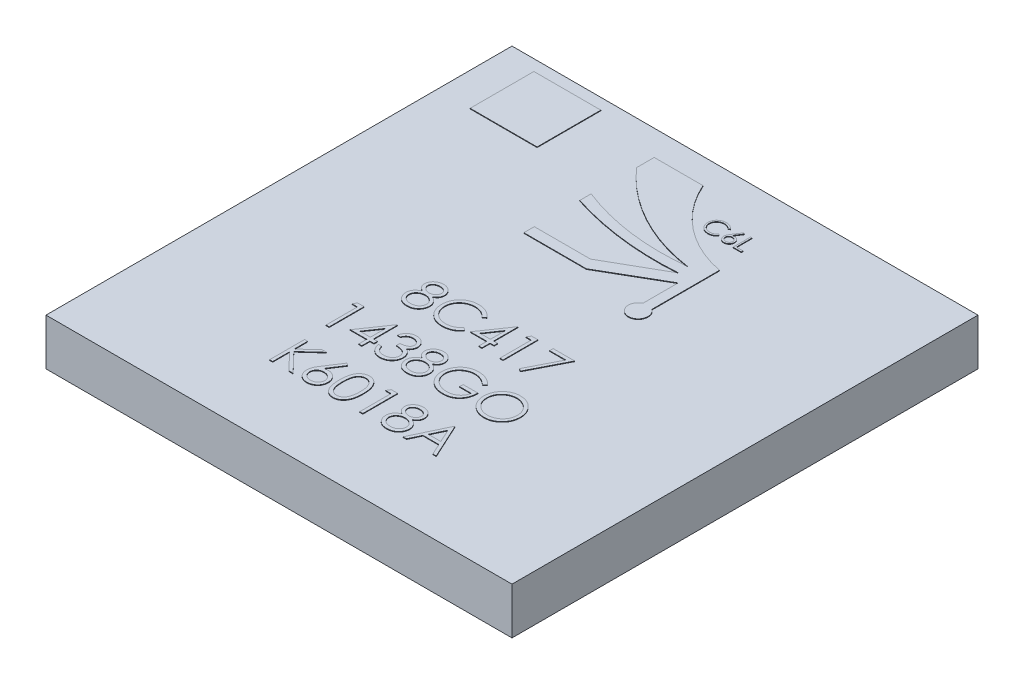
from build123d import *

# Parameters (mm, degrees)
ESQUISSE1_W        = 8
ESQUISSE1_H        = 8
BOSS_EXTRU_1_DEPTH = 0.8
BOSS_EXTRU_2_DEPTH = 0.01
ESQUISSE3_W        = 1.149270483
ESQUISSE3_H        = 1.094203325
BOSS_EXTRU_4_DEPTH = 0.01


with BuildPart() as part:
    # Esquisse1 → Boss.-Extru.1 (new body)
    with BuildSketch(Plane(origin=(0, 0, 0), x_dir=(1, 0, 0), z_dir=(0, 1, 0))):
        Rectangle(ESQUISSE1_W, ESQUISSE1_H)
    extrude(amount=BOSS_EXTRU_1_DEPTH)

    # Esquisse2 → Boss.-Extru.2 (add)
    # profile 1 of 20: a face of its own
    with BuildSketch(Plane(origin=(0, 0.8, 0), x_dir=(1, 0, 0), z_dir=(0, 1, 0))):
        with BuildLine():
            add(Edge.make_bspline(
                [(-0.946754808, -0.419953947), (-0.941843628, -0.422514739), (-0.932265188, -0.427509139), (-0.918623381, -0.435550996), (-0.906156238, -0.44402659), (-0.894517856, -0.452535594), (-0.88391271, -0.461403877), (-0.874459382, -0.470666704), (-0.865924361, -0.480092866), (-0.85847977, -0.489841981), (-0.851931741, -0.49988815), (-0.846272518, -0.51025774), (-0.841435283, -0.520928025), (-0.837601636, -0.532015482), (-0.834443615, -0.543357241), (-0.832270654, -0.555099752), (-0.831102039, -0.567165639), (-0.8308811, -0.575320205), (-0.830769231, -0.579449139)],
                knots=[0, 0, 0, 0, 1.272397273, 2.481599622, 3.635517121, 4.734568067, 5.792894095, 6.808321871, 7.773003508, 8.711915296, 9.623354172, 10.525449501, 11.423591555, 12.311487226, 13.218079475, 14.126165749, 15.051214107, 16, 16, 16, 16], degree=3))
            add(Edge.make_bspline(
                [(-0.830769231, -0.579449139), (-0.830901474, -0.585225893), (-0.831163234, -0.596660257), (-0.833443231, -0.613536733), (-0.836856885, -0.629927324), (-0.841841944, -0.645828437), (-0.848307097, -0.66115233), (-0.856274554, -0.675912119), (-0.865293618, -0.690349715), (-0.872536859, -0.699233041), (-0.876201923, -0.703727985)],
                knots=[0, 0, 0, 0, 1.025265484, 2.029385089, 3.018602448, 3.995076438, 4.983346944, 5.966715145, 6.97116228, 8, 8, 8, 8], degree=3))
            add(Edge.make_bspline(
                [(-0.876201923, -0.703727985), (-0.88097389, -0.708972632), (-0.890458856, -0.719397116), (-0.906707358, -0.732931541), (-0.92453968, -0.744305723), (-0.943886823, -0.75357519), (-0.964697069, -0.760789909), (-0.986965984, -0.765974341), (-1.010736982, -0.7689439), (-1.027075063, -0.769373155), (-1.035456731, -0.76959337)],
                knots=[0, 0, 0, 0, 0.954267603, 1.896743057, 2.838368354, 3.796610408, 4.779680527, 5.799409237, 6.871065594, 8, 8, 8, 8], degree=3))
            add(Edge.make_bspline(
                [(-1.035456731, -0.76959337), (-1.043516169, -0.769395802), (-1.059199017, -0.769011355), (-1.082026081, -0.766406596), (-1.103304322, -0.761841819), (-1.123157459, -0.755594171), (-1.141465807, -0.747466703), (-1.158177196, -0.737350976), (-1.173532734, -0.725654158), (-1.187066415, -0.712040316), (-1.199081577, -0.697458966), (-1.2096361, -0.682415833), (-1.218408799, -0.666909543), (-1.225836301, -0.651171309), (-1.231522248, -0.634980539), (-1.235460341, -0.618420537), (-1.237961366, -0.601520227), (-1.238294132, -0.590114801), (-1.238461538, -0.584377023)],
                knots=[0, 0, 0, 0, 1.256902934, 2.445805442, 3.576955095, 4.645999104, 5.686449165, 6.692658513, 7.68621702, 8.689161843, 9.678783111, 10.630372946, 11.551080876, 12.453998257, 13.34127905, 14.221779781, 15.105423033, 16, 16, 16, 16], degree=3))
            add(Edge.make_bspline(
                [(-1.238461538, -0.584377023), (-1.238362473, -0.580166876), (-1.238166685, -0.571846139), (-1.236811568, -0.559553112), (-1.234632975, -0.54758806), (-1.231674211, -0.53590679), (-1.227664321, -0.524594343), (-1.222822812, -0.513597119), (-1.217177335, -0.502902702), (-1.210649135, -0.492452608), (-1.203054502, -0.482393263), (-1.194455019, -0.47255395), (-1.184678813, -0.463087344), (-1.173834643, -0.453877785), (-1.162046436, -0.444761904), (-1.149008003, -0.436232351), (-1.135064985, -0.427685271), (-1.125155487, -0.422575272), (-1.120072115, -0.419953947)],
                knots=[0, 0, 0, 0, 0.941657376, 1.861047343, 2.762797495, 3.66048619, 4.553285746, 5.444104102, 6.34607688, 7.256116206, 8.197091036, 9.162375105, 10.176350973, 11.237807142, 12.343728897, 13.50695164, 14.721116704, 16, 16, 16, 16], degree=3))
            add(Edge.make_bspline(
                [(-1.120072115, -0.419953947), (-1.127030637, -0.416159415), (-1.140504282, -0.408812139), (-1.158344757, -0.395312687), (-1.173668864, -0.380691918), (-1.186055387, -0.364641096), (-1.195804912, -0.347661632), (-1.202493816, -0.32985976), (-1.207018927, -0.31156557), (-1.207467183, -0.299067364), (-1.207692308, -0.292790485)],
                knots=[0, 0, 0, 0, 1.166880483, 2.259407225, 3.286803203, 4.280235371, 5.237608625, 6.161067461, 7.076446754, 8, 8, 8, 8], degree=3))
            add(Edge.make_bspline(
                [(-1.207692308, -0.292790485), (-1.207411949, -0.286396618), (-1.20684838, -0.27354383), (-1.202291239, -0.254411352), (-1.194864942, -0.23561994), (-1.1847642, -0.217260675), (-1.172183534, -0.199954924), (-1.157089841, -0.184433619), (-1.139843561, -0.170837365), (-1.120530784, -0.159424307), (-1.099747429, -0.15013568), (-1.077819019, -0.14372795), (-1.055127621, -0.139538901), (-1.039682297, -0.139064618), (-1.031850962, -0.138824139)],
                knots=[0, 0, 0, 0, 0.888701115, 1.786444228, 2.72001202, 3.692817113, 4.693886446, 5.687152267, 6.695133018, 7.739871481, 8.800368666, 9.853104506, 10.91144658, 12, 12, 12, 12], degree=3))
            add(Edge.make_bspline(
                [(-1.031850962, -0.138824139), (-1.024221736, -0.139072083), (-1.009177773, -0.139561002), (-0.987064408, -0.143638752), (-0.965905858, -0.150449527), (-0.945775086, -0.159689051), (-0.92703248, -0.171069669), (-0.910472085, -0.184852676), (-0.895843642, -0.200305514), (-0.88374346, -0.217606017), (-0.873772679, -0.235894736), (-0.866829667, -0.255030025), (-0.862380758, -0.274598435), (-0.861819609, -0.287839236), (-0.861538462, -0.294473177)],
                knots=[0, 0, 0, 0, 1.072916533, 2.115669174, 3.151510826, 4.193348718, 5.225979165, 6.227137561, 7.216255879, 8.211077061, 9.189680878, 10.138522389, 11.067357538, 12, 12, 12, 12], degree=3))
            add(Edge.make_bspline(
                [(-0.861538462, -0.294473177), (-0.861784386, -0.300983463), (-0.862267368, -0.313769293), (-0.866330215, -0.332408125), (-0.873172497, -0.349863331), (-0.882514354, -0.36633298), (-0.894690152, -0.38151838), (-0.909537363, -0.395612632), (-0.926937617, -0.408731517), (-0.940010911, -0.416134894), (-0.946754808, -0.419953947)],
                knots=[0, 0, 0, 0, 0.975232327, 1.915300861, 2.843280834, 3.77672583, 4.742871857, 5.749627742, 6.839139064, 8, 8, 8, 8], degree=3))
        make_face()
        with BuildLine():
            add(Edge.make_bspline(
                [(-1.034855769, -0.2003626), (-1.039064479, -0.200474276), (-1.047298555, -0.200692762), (-1.059372041, -0.201834243), (-1.070853019, -0.204054794), (-1.081861442, -0.207010002), (-1.092246381, -0.211002228), (-1.102148876, -0.215698516), (-1.111400394, -0.221408127), (-1.120112618, -0.227812904), (-1.127955608, -0.234857402), (-1.134916388, -0.242196896), (-1.14069835, -0.249975535), (-1.145608255, -0.257999825), (-1.149170801, -0.266507924), (-1.151838967, -0.275238983), (-1.153642634, -0.284303335), (-1.153777787, -0.290498165), (-1.153846154, -0.293631831)],
                knots=[0, 0, 0, 0, 1.203892937, 2.355340988, 3.463153438, 4.544400666, 5.610487187, 6.640501085, 7.674077295, 8.714426146, 9.728707835, 10.68524104, 11.601827946, 12.495867327, 13.368432065, 14.231010473, 15.105153427, 16, 16, 16, 16], degree=3))
            add(Edge.make_bspline(
                [(-1.153846154, -0.293631831), (-1.15372832, -0.296765633), (-1.153495462, -0.302958475), (-1.151694583, -0.312103481), (-1.149010551, -0.321090047), (-1.144784723, -0.329704489), (-1.139716204, -0.338245636), (-1.133460523, -0.346500022), (-1.126005261, -0.354496374), (-1.117600557, -0.362166678), (-1.108444293, -0.369349323), (-1.098744171, -0.375584726), (-1.088621933, -0.380802002), (-1.078181578, -0.385144186), (-1.067316702, -0.388519603), (-1.056093878, -0.390914228), (-1.04451122, -0.392402571), (-1.03666312, -0.392580346), (-1.032692308, -0.392670293)],
                knots=[0, 0, 0, 0, 0.873023192, 1.725219244, 2.590779336, 3.480155217, 4.391973325, 5.357036234, 6.360879153, 7.436073238, 8.526419356, 9.601555421, 10.645666583, 11.697338044, 12.750135903, 13.812665442, 14.89329948, 16, 16, 16, 16], degree=3))
            add(Edge.make_bspline(
                [(-1.032692308, -0.392670293), (-1.02759229, -0.392520658), (-1.017442627, -0.392222867), (-1.002480456, -0.389454095), (-0.987932574, -0.385098795), (-0.973954476, -0.379139943), (-0.960907976, -0.371660882), (-0.94927825, -0.36270665), (-0.939164497, -0.352484005), (-0.930671821, -0.34115209), (-0.924087275, -0.329091818), (-0.918961251, -0.31698891), (-0.9159679, -0.304714242), (-0.91557746, -0.296491334), (-0.915384615, -0.292429908)],
                knots=[0, 0, 0, 0, 1.076279235, 2.141928126, 3.20205304, 4.278698113, 5.344010996, 6.36967002, 7.368914609, 8.37248503, 9.349703398, 10.264243087, 11.142681841, 12, 12, 12, 12], degree=3))
            add(Edge.make_bspline(
                [(-0.915384615, -0.292429908), (-0.915475798, -0.289579388), (-0.915656782, -0.283921513), (-0.91714822, -0.275566365), (-0.919612649, -0.267401293), (-0.922949177, -0.259358847), (-0.927339427, -0.251551864), (-0.932544716, -0.243857621), (-0.938867774, -0.236449204), (-0.945964305, -0.229153967), (-0.95401209, -0.22240242), (-0.962995617, -0.216465041), (-0.972868832, -0.211422923), (-0.983631966, -0.207327708), (-0.995245382, -0.204251877), (-1.007655589, -0.201948503), (-1.020966065, -0.200650255), (-1.030125451, -0.200460565), (-1.034855769, -0.2003626)],
                knots=[0, 0, 0, 0, 0.814439003, 1.616544685, 2.417341072, 3.248991801, 4.09997495, 4.973547432, 5.9003056, 6.880240646, 7.880314356, 8.896779544, 9.951930927, 11.043077905, 12.18215768, 13.381699519, 14.647792085, 16, 16, 16, 16], degree=3))
        make_face(mode=Mode.SUBTRACT)
        with BuildLine():
            add(Edge.make_bspline(
                [(-1.031370192, -0.454208754), (-1.036706041, -0.454303664), (-1.047173675, -0.454489854), (-1.062509148, -0.45656234), (-1.077226834, -0.459447379), (-1.091277109, -0.463824094), (-1.10465404, -0.469514921), (-1.117430042, -0.476360842), (-1.129507379, -0.484453204), (-1.140719275, -0.493689195), (-1.15095756, -0.503642244), (-1.159940125, -0.51417861), (-1.167568272, -0.525102473), (-1.173711115, -0.53655257), (-1.178753126, -0.548286446), (-1.182064076, -0.560596319), (-1.184186656, -0.573245539), (-1.184471678, -0.581844413), (-1.184615385, -0.586179908)],
                knots=[0, 0, 0, 0, 1.140299081, 2.23698856, 3.303958914, 4.344563908, 5.37730929, 6.408454204, 7.439741482, 8.480804886, 9.510774543, 10.48932336, 11.43758569, 12.353841022, 13.263987381, 14.161954604, 15.073269652, 16, 16, 16, 16], degree=3))
            add(Edge.make_bspline(
                [(-1.184615385, -0.586179908), (-1.184381683, -0.591568063), (-1.183918025, -0.602258038), (-1.180239744, -0.618057421), (-1.174336509, -0.633352459), (-1.166103615, -0.648018508), (-1.155909174, -0.661724241), (-1.143373208, -0.673670888), (-1.129274779, -0.684285999), (-1.113136861, -0.692871233), (-1.095509124, -0.699727494), (-1.076396256, -0.704451373), (-1.056072556, -0.707578479), (-1.042039483, -0.707893596), (-1.034855769, -0.708054908)],
                knots=[0, 0, 0, 0, 0.898778495, 1.783155532, 2.693654817, 3.627872908, 4.583023416, 5.533784346, 6.509005473, 7.520592997, 8.575161974, 9.658835044, 10.801527049, 12, 12, 12, 12], degree=3))
            add(Edge.make_bspline(
                [(-1.034855769, -0.708054908), (-1.02924142, -0.707947112), (-1.018302869, -0.707737092), (-1.002345277, -0.705883213), (-0.987286212, -0.702943277), (-0.973154875, -0.698667241), (-0.959793074, -0.693447245), (-0.947427356, -0.686732031), (-0.935739609, -0.67909449), (-0.925305759, -0.670033091), (-0.915802923, -0.660350892), (-0.907517216, -0.65010117), (-0.900324493, -0.639562491), (-0.894679186, -0.628496693), (-0.890166114, -0.617116079), (-0.886922076, -0.605315706), (-0.884920439, -0.59305938), (-0.884718, -0.584745254), (-0.884615385, -0.58053087)],
                knots=[0, 0, 0, 0, 1.224942928, 2.386581632, 3.501229538, 4.569074225, 5.605009692, 6.626002462, 7.634866581, 8.645888296, 9.63523824, 10.59253846, 11.518950513, 12.414518923, 13.29783783, 14.186679152, 15.080837789, 16, 16, 16, 16], degree=3))
            add(Edge.make_bspline(
                [(-0.884615385, -0.58053087), (-0.884770673, -0.576437611), (-0.885076874, -0.568366421), (-0.887020307, -0.556406445), (-0.890434458, -0.544851677), (-0.895119154, -0.533563104), (-0.901355891, -0.522769455), (-0.908700725, -0.51218954), (-0.917562574, -0.502117007), (-0.927576162, -0.492473619), (-0.938489127, -0.483556636), (-0.950089209, -0.475668446), (-0.962287117, -0.469025226), (-0.975057039, -0.463622398), (-0.98837062, -0.459373118), (-1.002218067, -0.456404662), (-1.016615594, -0.454536158), (-1.026396429, -0.454319122), (-1.031370192, -0.454208754)],
                knots=[0, 0, 0, 0, 0.917430815, 1.809013306, 2.70690318, 3.612392954, 4.541220862, 5.495268465, 6.494511384, 7.542276156, 8.608045339, 9.649016899, 10.681629292, 11.715607085, 12.752076957, 13.808767841, 14.885711793, 16, 16, 16, 16], degree=3))
        make_face(mode=Mode.SUBTRACT)
    # profile 2 of 20: a face of its own
    with BuildSketch(Plane(origin=(0, 0.8, 0), x_dir=(1, 0, 0), z_dir=(0, 1, 0))):
        with BuildLine():
            Line((-0.169230769, -0.264304908), (-0.216346154, -0.3003626))
            add(Edge.make_bspline(
                [(-0.216346154, -0.3003626), (-0.219707163, -0.296357006), (-0.226383868, -0.28839982), (-0.237125446, -0.277226184), (-0.248320013, -0.266757853), (-0.259963291, -0.25694496), (-0.272264855, -0.248130657), (-0.284926706, -0.239855611), (-0.298160656, -0.232438284), (-0.316460954, -0.223444629), (-0.340400585, -0.214059574), (-0.370536843, -0.206190449), (-0.401995889, -0.201181105), (-0.423458334, -0.20063856), (-0.434375, -0.2003626)],
                knots=[0, 0, 0, 0, 0.757959112, 1.505699292, 2.245454638, 2.979532153, 3.711538275, 4.438200793, 5.171680507, 5.909471876, 7.393775596, 8.890124382, 10.418191784, 12, 12, 12, 12], degree=3))
            add(Edge.make_bspline(
                [(-0.434375, -0.2003626), (-0.44038928, -0.200431851), (-0.452362021, -0.20056971), (-0.470130331, -0.202388417), (-0.487566854, -0.204944624), (-0.504660248, -0.208737537), (-0.521388756, -0.213532843), (-0.537861739, -0.219262914), (-0.553840699, -0.226352315), (-0.569546683, -0.234188017), (-0.584594547, -0.243038436), (-0.598832555, -0.252692153), (-0.612208779, -0.263041141), (-0.624733798, -0.274124188), (-0.636420417, -0.285891381), (-0.647183956, -0.298468126), (-0.65698717, -0.311814213), (-0.666024374, -0.325753654), (-0.674117985, -0.340245847), (-0.680894536, -0.35534443), (-0.686895414, -0.370790848), (-0.691643856, -0.386759618), (-0.695402344, -0.403138378), (-0.697995658, -0.419971085), (-0.699793682, -0.437222573), (-0.699930855, -0.448915598), (-0.7, -0.454809716)],
                knots=[0, 0, 0, 0, 1.054917814, 2.100044995, 3.131103042, 4.146048494, 5.169673617, 6.183595914, 7.203665975, 8.234915748, 9.262203917, 10.264457458, 11.251630812, 12.227803204, 13.197192746, 14.159520551, 15.12972552, 16.100847026, 17.073214652, 18.039054194, 19.002613845, 19.979014051, 20.95965708, 21.949030935, 22.966165397, 24, 24, 24, 24], degree=3))
            add(Edge.make_bspline(
                [(-0.7, -0.454809716), (-0.699783688, -0.463677942), (-0.699358989, -0.481089528), (-0.695579274, -0.506593061), (-0.689835544, -0.531025177), (-0.68122716, -0.55423315), (-0.670612465, -0.576503154), (-0.657199789, -0.597458386), (-0.641665525, -0.617415511), (-0.623789911, -0.635902874), (-0.604177485, -0.652790941), (-0.583134986, -0.667662469), (-0.560714822, -0.680059306), (-0.537164543, -0.690375183), (-0.512302923, -0.698304908), (-0.486174671, -0.703887329), (-0.458836615, -0.707528845), (-0.440156147, -0.707877478), (-0.430649038, -0.708054908)],
                knots=[0, 0, 0, 0, 1.029171465, 2.020641659, 2.987623507, 3.938342917, 4.889210282, 5.84687017, 6.821220943, 7.821438502, 8.827599549, 9.822697543, 10.807740252, 11.797342354, 12.80366471, 13.83203677, 14.896651826, 16, 16, 16, 16], degree=3))
            add(Edge.make_bspline(
                [(-0.430649038, -0.708054908), (-0.420174292, -0.707765403), (-0.399557485, -0.707195588), (-0.369322966, -0.702368288), (-0.340379692, -0.694541216), (-0.312726105, -0.683587287), (-0.286440166, -0.669347523), (-0.261480739, -0.65208503), (-0.237826755, -0.631635601), (-0.223603107, -0.616021351), (-0.216346154, -0.608054908)],
                knots=[0, 0, 0, 0, 1.028121516, 2.023589091, 2.998037872, 3.967518031, 4.937445131, 5.927275754, 6.942489185, 8, 8, 8, 8], degree=3))
            Line((-0.216346154, -0.608054908), (-0.169230769, -0.643752023))
            add(Edge.make_bspline(
                [(-0.169230769, -0.643752023), (-0.173022445, -0.648644329), (-0.180587635, -0.658405508), (-0.192837581, -0.672166372), (-0.205742261, -0.685109921), (-0.219397525, -0.697131799), (-0.233646289, -0.708472565), (-0.2487444, -0.718810021), (-0.264493377, -0.728288459), (-0.280839859, -0.73696736), (-0.297766479, -0.74466746), (-0.315252953, -0.751259534), (-0.333223909, -0.756938087), (-0.351680167, -0.761609847), (-0.370660012, -0.765256319), (-0.39009495, -0.767693977), (-0.410026929, -0.76936402), (-0.423474029, -0.769516234), (-0.430288462, -0.76959337)],
                knots=[0, 0, 0, 0, 0.986787822, 1.968848986, 2.935600012, 3.899624008, 4.868462664, 5.837806735, 6.815139263, 7.798259679, 8.787526145, 9.778297419, 10.776456485, 11.791383307, 12.812564526, 13.85620153, 14.913611965, 16, 16, 16, 16], degree=3))
            add(Edge.make_bspline(
                [(-0.430288462, -0.76959337), (-0.436741662, -0.769548457), (-0.449502066, -0.769459647), (-0.468341852, -0.768020989), (-0.486682923, -0.766058177), (-0.504472858, -0.763102726), (-0.52180874, -0.759615125), (-0.538533412, -0.754940053), (-0.554811448, -0.749703053), (-0.570577449, -0.743547912), (-0.585844826, -0.736602281), (-0.600564336, -0.728752299), (-0.614729211, -0.72006398), (-0.628478711, -0.710728835), (-0.641609726, -0.700447012), (-0.654236044, -0.689361303), (-0.666428469, -0.677509073), (-0.673971786, -0.668962526), (-0.677764423, -0.664665485)],
                knots=[0, 0, 0, 0, 1.114604814, 2.203992996, 3.262667896, 4.300477797, 5.318619304, 6.316056647, 7.298880507, 8.271930387, 9.238335007, 10.195173496, 11.151986948, 12.108099108, 13.064862484, 14.031167946, 15.010108607, 16, 16, 16, 16], degree=3))
            add(Edge.make_bspline(
                [(-0.677764423, -0.664665485), (-0.683839105, -0.657201281), (-0.695915129, -0.642362988), (-0.711365247, -0.618313963), (-0.724590542, -0.593205127), (-0.735283557, -0.566904568), (-0.743642882, -0.539471301), (-0.749433944, -0.510891499), (-0.753197077, -0.481191851), (-0.753627412, -0.460991259), (-0.753846154, -0.450723177)],
                knots=[0, 0, 0, 0, 0.994628077, 1.977248131, 2.950237994, 3.925870899, 4.908910175, 5.911660606, 6.938484602, 8, 8, 8, 8], degree=3))
            add(Edge.make_bspline(
                [(-0.753846154, -0.450723177), (-0.753579549, -0.439930814), (-0.753055021, -0.418697512), (-0.748598599, -0.387536263), (-0.741429663, -0.357681738), (-0.731247339, -0.329189667), (-0.71833785, -0.301910191), (-0.702390431, -0.276051698), (-0.683590349, -0.251448819), (-0.662085052, -0.228474861), (-0.63850208, -0.207468115), (-0.613247426, -0.188987051), (-0.586370521, -0.173606906), (-0.558167461, -0.160750421), (-0.528427058, -0.150868513), (-0.497212766, -0.143950824), (-0.464583238, -0.139645032), (-0.442321108, -0.139100711), (-0.431009615, -0.138824139)],
                knots=[0, 0, 0, 0, 1.032925535, 2.032216505, 3.007276963, 3.968222605, 4.92396291, 5.891752235, 6.871517503, 7.883894988, 8.900124299, 9.891468569, 10.874487609, 11.85992873, 12.854644235, 13.869047385, 14.917252991, 16, 16, 16, 16], degree=3))
            add(Edge.make_bspline(
                [(-0.431009615, -0.138824139), (-0.424115706, -0.138906791), (-0.410469906, -0.139070393), (-0.390283737, -0.140665732), (-0.370630767, -0.143325207), (-0.351497456, -0.146945105), (-0.332790722, -0.151437788), (-0.314653537, -0.157290411), (-0.296979477, -0.163982388), (-0.279880007, -0.171689553), (-0.26343717, -0.180340995), (-0.247656087, -0.189840816), (-0.232662111, -0.20017724), (-0.218349737, -0.211262355), (-0.204958386, -0.22333068), (-0.192107847, -0.236050268), (-0.180234519, -0.249787495), (-0.1729054, -0.259456912), (-0.169230769, -0.264304908)],
                knots=[0, 0, 0, 0, 1.096760587, 2.17092713, 3.219439832, 4.250915756, 5.268269357, 6.278326846, 7.281116186, 8.274029601, 9.260640565, 10.235837813, 11.203064059, 12.156899882, 13.114053108, 14.069676657, 15.032185724, 16, 16, 16, 16], degree=3))
        make_face()
    # profile 3 of 20: a face of its own
    with BuildSketch(Plane(origin=(0, 0.8, 0), x_dir=(1, 0, 0), z_dir=(0, 1, 0))):
        Polygon((0.227524038, -0.138824139), (0.238461538, -0.138824139), (0.238461538, -0.554208754), (0.307692308, -0.554208754), (0.307692308, -0.615747216), (0.238461538, -0.615747216), (0.238461538, -0.754208754), (0.184615385, -0.754208754), (0.184615385, -0.615747216), (-0.1, -0.615747216), align=None)
        Polygon((0.184615385, -0.554208754), (0.184615385, -0.293631831), (0.005769231, -0.554208754), align=None, mode=Mode.SUBTRACT)
    # profile 4 of 20: a face of its own
    with BuildSketch(Plane(origin=(0, 0.8, 0), x_dir=(1, 0, 0), z_dir=(0, 1, 0))):
        Polygon((0.4890625, -0.154208754), (0.6, -0.154208754), (0.6, -0.754208754), (0.546153846, -0.754208754), (0.546153846, -0.215747216), (0.453846154, -0.215747216), align=None)
    # profile 5 of 20: a face of its own
    with BuildSketch(Plane(origin=(0, 0.8, 0), x_dir=(1, 0, 0), z_dir=(0, 1, 0))):
        Polygon((0.861538462, -0.154208754), (1.230769231, -0.154208754), (0.915384615, -0.76959337), (0.868870192, -0.743992408), (1.139663462, -0.215747216), (0.861538462, -0.215747216), align=None)
    # profile 6 of 20: a face of its own
    with BuildSketch(Plane(origin=(0, 0.8, 0), x_dir=(1, 0, 0), z_dir=(0, 1, 0))):
        Polygon((-1.495552885, -1.154208754), (-1.384615385, -1.154208754), (-1.384615385, -1.754208754), (-1.438461538, -1.754208754), (-1.438461538, -1.215747216), (-1.530769231, -1.215747216), align=None)
    # profile 7 of 20: a face of its own
    with BuildSketch(Plane(origin=(0, 0.8, 0), x_dir=(1, 0, 0), z_dir=(0, 1, 0))):
        Polygon((-0.834014423, -1.138824139), (-0.823076923, -1.138824139), (-0.823076923, -1.554208754), (-0.753846154, -1.554208754), (-0.753846154, -1.615747216), (-0.823076923, -1.615747216), (-0.823076923, -1.754208754), (-0.876923077, -1.754208754), (-0.876923077, -1.615747216), (-1.161538462, -1.615747216), align=None)
        Polygon((-0.876923077, -1.554208754), (-0.876923077, -1.293631831), (-1.055769231, -1.554208754), align=None, mode=Mode.SUBTRACT)
    # profile 8 of 20: a face of its own
    with BuildSketch(Plane(origin=(0, 0.8, 0), x_dir=(1, 0, 0), z_dir=(0, 1, 0))):
        with BuildLine():
            Line((-0.623076923, -1.292670293), (-0.676923077, -1.292670293))
            add(Edge.make_bspline(
                [(-0.676923077, -1.292670293), (-0.675464297, -1.286630438), (-0.672612501, -1.274823017), (-0.666664346, -1.257953201), (-0.660184473, -1.241989169), (-0.652403484, -1.227229842), (-0.643916269, -1.213378601), (-0.634192374, -1.200749608), (-0.623680421, -1.189021671), (-0.612053287, -1.178613688), (-0.599859802, -1.169188934), (-0.586928153, -1.16115321), (-0.573518514, -1.154240498), (-0.559537977, -1.148545601), (-0.544944919, -1.144255512), (-0.529871269, -1.141142916), (-0.514277527, -1.139121583), (-0.503692225, -1.138924309), (-0.498317308, -1.138824139)],
                knots=[0, 0, 0, 0, 1.162005537, 2.271625781, 3.343758855, 4.383309926, 5.390229558, 6.379919256, 7.361854164, 8.333198761, 9.295911338, 10.242430842, 11.177959212, 12.116337295, 13.062827104, 14.020064771, 14.994644689, 16, 16, 16, 16], degree=3))
            add(Edge.make_bspline(
                [(-0.498317308, -1.138824139), (-0.49048598, -1.139060578), (-0.47499415, -1.1395283), (-0.452234771, -1.143799346), (-0.430287316, -1.15055794), (-0.409392016, -1.159896293), (-0.389983142, -1.171414119), (-0.372714081, -1.185122359), (-0.357818908, -1.200756525), (-0.345322729, -1.218024965), (-0.335538444, -1.236480195), (-0.328323637, -1.255474508), (-0.323931349, -1.274962845), (-0.32336211, -1.288121236), (-0.323076923, -1.294713562)],
                knots=[0, 0, 0, 0, 1.083050992, 2.142477498, 3.193116406, 4.255571735, 5.30263384, 6.308962982, 7.297363603, 8.282367274, 9.249857812, 10.179914175, 11.08814088, 12, 12, 12, 12], degree=3))
            add(Edge.make_bspline(
                [(-0.323076923, -1.294713562), (-0.323276396, -1.301057584), (-0.323666733, -1.31347185), (-0.326981083, -1.331595536), (-0.332558728, -1.348676953), (-0.340284973, -1.364788009), (-0.350286381, -1.379826553), (-0.362401701, -1.39382642), (-0.376716443, -1.406849704), (-0.387564261, -1.414310185), (-0.393149038, -1.418151062)],
                knots=[0, 0, 0, 0, 1.024540389, 2.004866551, 2.965041327, 3.920577974, 4.882998113, 5.874504559, 6.905732034, 8, 8, 8, 8], degree=3))
            add(Edge.make_bspline(
                [(-0.393149038, -1.418151062), (-0.386766452, -1.421233034), (-0.374120702, -1.427339313), (-0.356883468, -1.439314585), (-0.341235833, -1.453141388), (-0.332509481, -1.463931557), (-0.328125, -1.469352985)],
                knots=[0, 0, 0, 0, 1.015518401, 2.012035669, 3.001164323, 4, 4, 4, 4], degree=3))
            add(Edge.make_bspline(
                [(-0.328125, -1.469352985), (-0.325237913, -1.473305742), (-0.319511016, -1.481146528), (-0.312442068, -1.493752773), (-0.306029077, -1.506498742), (-0.301031896, -1.519726069), (-0.29716209, -1.533281443), (-0.294395913, -1.547188139), (-0.292677489, -1.561457514), (-0.292431395, -1.571111082), (-0.292307692, -1.575963562)],
                knots=[0, 0, 0, 0, 1.025084078, 2.033381695, 3.024893161, 4.013698104, 4.991890475, 5.976764909, 6.982997093, 8, 8, 8, 8], degree=3))
            add(Edge.make_bspline(
                [(-0.292307692, -1.575963562), (-0.292615323, -1.584365228), (-0.293229137, -1.601129023), (-0.29871555, -1.625896118), (-0.307220677, -1.650106204), (-0.319299009, -1.673261891), (-0.334019153, -1.694927099), (-0.351531837, -1.714311609), (-0.371638079, -1.730974227), (-0.394061904, -1.744895981), (-0.418356269, -1.756024767), (-0.444340656, -1.7637489), (-0.471640666, -1.768779643), (-0.490361917, -1.769319106), (-0.499879808, -1.76959337)],
                knots=[0, 0, 0, 0, 0.955779014, 1.907060117, 2.875433937, 3.871313158, 4.872415639, 5.851225146, 6.836215519, 7.83643374, 8.849228613, 9.86973379, 10.916971861, 12, 12, 12, 12], degree=3))
            add(Edge.make_bspline(
                [(-0.499879808, -1.76959337), (-0.506294545, -1.769444533), (-0.518916609, -1.769151672), (-0.537472637, -1.767149626), (-0.555184928, -1.763493054), (-0.572077431, -1.758572487), (-0.588165151, -1.752333903), (-0.603398998, -1.744564983), (-0.617872694, -1.735425869), (-0.631449657, -1.724808682), (-0.644128269, -1.712931881), (-0.655571593, -1.699584622), (-0.665970414, -1.685013639), (-0.675046295, -1.669049686), (-0.68321263, -1.651899071), (-0.689929365, -1.633342185), (-0.695841177, -1.613544924), (-0.698589771, -1.59974874), (-0.7, -1.592670293)],
                knots=[0, 0, 0, 0, 1.048658725, 2.063410685, 3.046034179, 4.001477787, 4.936774919, 5.862367409, 6.792675028, 7.730719943, 8.675894397, 9.627829632, 10.600096036, 11.597688215, 12.626045268, 13.701542398, 14.82072376, 16, 16, 16, 16], degree=3))
            Line((-0.7, -1.592670293), (-0.646153846, -1.592670293))
            add(Edge.make_bspline(
                [(-0.646153846, -1.592670293), (-0.644750996, -1.597290124), (-0.642022331, -1.606276096), (-0.637377594, -1.61920872), (-0.632085891, -1.631064386), (-0.626409109, -1.641930064), (-0.62044709, -1.651912762), (-0.61377596, -1.66074851), (-0.606889821, -1.668825402), (-0.601699074, -1.673375907), (-0.599158654, -1.675602985)],
                knots=[0, 0, 0, 0, 1.198163088, 2.33053128, 3.407730985, 4.417276592, 5.372219308, 6.28897303, 7.162600585, 8, 8, 8, 8], degree=3))
            add(Edge.make_bspline(
                [(-0.599158654, -1.675602985), (-0.595799241, -1.678192985), (-0.589090784, -1.683364991), (-0.578159087, -1.68996527), (-0.56666225, -1.695684303), (-0.554351163, -1.700052936), (-0.541491488, -1.703751964), (-0.527875368, -1.706172624), (-0.513622931, -1.707833454), (-0.503891314, -1.707980013), (-0.498918269, -1.708054908)],
                knots=[0, 0, 0, 0, 0.946170439, 1.889420265, 2.845303464, 3.807233317, 4.801018734, 5.828864929, 6.890507805, 8, 8, 8, 8], degree=3))
            add(Edge.make_bspline(
                [(-0.498918269, -1.708054908), (-0.493303383, -1.707949324), (-0.482323958, -1.707742864), (-0.466303125, -1.705844172), (-0.451061848, -1.703078958), (-0.436769347, -1.698808161), (-0.423238402, -1.693531444), (-0.410658691, -1.686906003), (-0.398865073, -1.679132622), (-0.388008603, -1.670297337), (-0.378246516, -1.660625081), (-0.369651171, -1.650508555), (-0.362344086, -1.639990412), (-0.356449759, -1.629012449), (-0.351795379, -1.617620124), (-0.34862683, -1.605781467), (-0.346423713, -1.593593365), (-0.346244294, -1.585308399), (-0.346153846, -1.581131831)],
                knots=[0, 0, 0, 0, 1.217147791, 2.380027433, 3.494444702, 4.572153297, 5.609568379, 6.639424714, 7.649109417, 8.668170816, 9.669597737, 10.625200337, 11.543417969, 12.441394052, 13.322311151, 14.205496177, 15.095365482, 16, 16, 16, 16], degree=3))
            add(Edge.make_bspline(
                [(-0.346153846, -1.581131831), (-0.346416184, -1.575541316), (-0.346939553, -1.564388103), (-0.350935309, -1.547979376), (-0.357507686, -1.532169648), (-0.366708688, -1.517228656), (-0.377909099, -1.503381358), (-0.391000226, -1.491026247), (-0.406090779, -1.480831374), (-0.4199799, -1.473787604), (-0.432282498, -1.468981249), (-0.442810849, -1.465779826), (-0.454597696, -1.463068914), (-0.467500498, -1.46054681), (-0.481616478, -1.458400293), (-0.496930268, -1.456610268), (-0.51344497, -1.455177975), (-0.524877741, -1.454538359), (-0.530769231, -1.454208754)],
                knots=[0, 0, 0, 0, 1.07054697, 2.135767047, 3.216561865, 4.33974944, 5.486079747, 6.621378074, 7.775625952, 8.963672916, 9.598146892, 10.304877434, 11.070270905, 11.915000392, 12.823868403, 13.805723172, 14.86925407, 16, 16, 16, 16], degree=3))
            Line((-0.530769231, -1.454208754), (-0.530769231, -1.392670293))
            add(Edge.make_bspline(
                [(-0.530769231, -1.392670293), (-0.523346174, -1.392544326), (-0.508806229, -1.392297589), (-0.487567205, -1.389313359), (-0.467257494, -1.385185251), (-0.448327196, -1.378862075), (-0.431073131, -1.371518024), (-0.416104056, -1.362971931), (-0.403629688, -1.35347226), (-0.393710647, -1.342872384), (-0.386248494, -1.33150409), (-0.380792471, -1.31965552), (-0.377569558, -1.307222824), (-0.377139329, -1.298738024), (-0.376923077, -1.294473177)],
                knots=[0, 0, 0, 0, 1.321986639, 2.589447074, 3.816329219, 5.01088745, 6.139805852, 7.153945165, 8.075214402, 8.924034688, 9.728124013, 10.488707548, 11.240355623, 12, 12, 12, 12], degree=3))
            add(Edge.make_bspline(
                [(-0.376923077, -1.294473177), (-0.376994119, -1.29133985), (-0.377135453, -1.285106243), (-0.378917844, -1.275999088), (-0.381596251, -1.267170354), (-0.38527849, -1.258657587), (-0.390207096, -1.250519826), (-0.396105265, -1.242687692), (-0.403128368, -1.235205901), (-0.411176158, -1.228232132), (-0.419818182, -1.221585977), (-0.429289572, -1.215943639), (-0.439304751, -1.211118771), (-0.449874806, -1.20714), (-0.46103404, -1.204146979), (-0.472730021, -1.201997977), (-0.484985052, -1.200654379), (-0.493345921, -1.200460937), (-0.497596154, -1.2003626)],
                knots=[0, 0, 0, 0, 0.884392785, 1.759457502, 2.611959086, 3.489218968, 4.37281399, 5.2945488, 6.255912374, 7.266815255, 8.301784654, 9.332968512, 10.37626691, 11.440494194, 12.520033166, 13.637162961, 14.798855837, 16, 16, 16, 16], degree=3))
            add(Edge.make_bspline(
                [(-0.497596154, -1.2003626), (-0.504427868, -1.20060112), (-0.517771796, -1.201067003), (-0.537008639, -1.20514752), (-0.554891953, -1.211658048), (-0.568561439, -1.219429423), (-0.578655594, -1.227100926), (-0.585868784, -1.233800764), (-0.5929523, -1.241246391), (-0.59944013, -1.249896398), (-0.606001383, -1.25916499), (-0.611974737, -1.269523336), (-0.617779255, -1.280701232), (-0.621276835, -1.288603341), (-0.623076923, -1.292670293)],
                knots=[0, 0, 0, 0, 1.472543308, 2.876219568, 4.221790263, 5.565193594, 6.249813518, 6.953379497, 7.687249741, 8.463570142, 9.283606569, 10.136032583, 11.040678096, 12, 12, 12, 12], degree=3))
        make_face()
    # profile 9 of 20: a face of its own
    with BuildSketch(Plane(origin=(0, 0.8, 0), x_dir=(1, 0, 0), z_dir=(0, 1, 0))):
        with BuildLine():
            add(Edge.make_bspline(
                [(0.053245192, -1.419953947), (0.058156372, -1.422514739), (0.067734812, -1.427509139), (0.081376619, -1.435550996), (0.093843762, -1.44402659), (0.105482144, -1.452535594), (0.11608729, -1.461403877), (0.125540618, -1.470666704), (0.134075639, -1.480092866), (0.14152023, -1.489841981), (0.148068259, -1.49988815), (0.153727482, -1.51025774), (0.158564717, -1.520928025), (0.162398364, -1.532015482), (0.165556385, -1.543357241), (0.167729346, -1.555099752), (0.168897961, -1.567165639), (0.1691189, -1.575320205), (0.169230769, -1.579449139)],
                knots=[0, 0, 0, 0, 1.272397273, 2.481599622, 3.635517121, 4.734568067, 5.792894095, 6.808321871, 7.773003508, 8.711915296, 9.623354172, 10.525449501, 11.423591555, 12.311487226, 13.218079475, 14.126165749, 15.051214107, 16, 16, 16, 16], degree=3))
            add(Edge.make_bspline(
                [(0.169230769, -1.579449139), (0.169098526, -1.585225893), (0.168836766, -1.596660257), (0.166556769, -1.613536733), (0.163143115, -1.629927324), (0.158158056, -1.645828437), (0.151692903, -1.66115233), (0.143725446, -1.675912119), (0.134706382, -1.690349715), (0.127463141, -1.699233041), (0.123798077, -1.703727985)],
                knots=[0, 0, 0, 0, 1.025265484, 2.029385089, 3.018602448, 3.995076438, 4.983346944, 5.966715145, 6.97116228, 8, 8, 8, 8], degree=3))
            add(Edge.make_bspline(
                [(0.123798077, -1.703727985), (0.11902611, -1.708972632), (0.109541144, -1.719397116), (0.093292642, -1.732931541), (0.07546032, -1.744305723), (0.056113177, -1.75357519), (0.035302931, -1.760789909), (0.013034016, -1.765974341), (-0.010736982, -1.7689439), (-0.027075063, -1.769373155), (-0.035456731, -1.76959337)],
                knots=[0, 0, 0, 0, 0.954267603, 1.896743057, 2.838368354, 3.796610408, 4.779680527, 5.799409237, 6.871065594, 8, 8, 8, 8], degree=3))
            add(Edge.make_bspline(
                [(-0.035456731, -1.76959337), (-0.043516169, -1.769395802), (-0.059199017, -1.769011355), (-0.082026081, -1.766406596), (-0.103304322, -1.761841819), (-0.123157459, -1.755594171), (-0.141465807, -1.747466703), (-0.158177196, -1.737350976), (-0.173532734, -1.725654158), (-0.187066415, -1.712040316), (-0.199081577, -1.697458966), (-0.2096361, -1.682415833), (-0.218408799, -1.666909543), (-0.225836301, -1.651171309), (-0.231522248, -1.634980539), (-0.235460341, -1.618420537), (-0.237961366, -1.601520227), (-0.238294132, -1.590114801), (-0.238461538, -1.584377023)],
                knots=[0, 0, 0, 0, 1.256902934, 2.445805442, 3.576955095, 4.645999104, 5.686449165, 6.692658513, 7.68621702, 8.689161843, 9.678783111, 10.630372946, 11.551080876, 12.453998257, 13.34127905, 14.221779781, 15.105423033, 16, 16, 16, 16], degree=3))
            add(Edge.make_bspline(
                [(-0.238461538, -1.584377023), (-0.238362473, -1.580166876), (-0.238166685, -1.571846139), (-0.236811568, -1.559553112), (-0.234632975, -1.54758806), (-0.231674211, -1.53590679), (-0.227664321, -1.524594343), (-0.222822812, -1.513597119), (-0.217177335, -1.502902702), (-0.210649135, -1.492452608), (-0.203054502, -1.482393263), (-0.194455019, -1.47255395), (-0.184678813, -1.463087344), (-0.173834643, -1.453877785), (-0.162046436, -1.444761904), (-0.149008003, -1.436232351), (-0.135064985, -1.427685271), (-0.125155487, -1.422575272), (-0.120072115, -1.419953947)],
                knots=[0, 0, 0, 0, 0.941657376, 1.861047343, 2.762797495, 3.66048619, 4.553285746, 5.444104102, 6.34607688, 7.256116206, 8.197091036, 9.162375105, 10.176350973, 11.237807142, 12.343728897, 13.50695164, 14.721116704, 16, 16, 16, 16], degree=3))
            add(Edge.make_bspline(
                [(-0.120072115, -1.419953947), (-0.127030637, -1.416159415), (-0.140504282, -1.408812139), (-0.158344757, -1.395312687), (-0.173668864, -1.380691918), (-0.186055387, -1.364641096), (-0.195804912, -1.347661632), (-0.202493816, -1.32985976), (-0.207018927, -1.31156557), (-0.207467183, -1.299067364), (-0.207692308, -1.292790485)],
                knots=[0, 0, 0, 0, 1.166880483, 2.259407225, 3.286803203, 4.280235371, 5.237608625, 6.161067461, 7.076446754, 8, 8, 8, 8], degree=3))
            add(Edge.make_bspline(
                [(-0.207692308, -1.292790485), (-0.207411949, -1.286396618), (-0.20684838, -1.27354383), (-0.202291239, -1.254411352), (-0.194864942, -1.23561994), (-0.1847642, -1.217260675), (-0.172183534, -1.199954924), (-0.157089841, -1.184433619), (-0.139843561, -1.170837365), (-0.120530784, -1.159424307), (-0.099747429, -1.15013568), (-0.077819019, -1.14372795), (-0.055127621, -1.139538901), (-0.039682297, -1.139064618), (-0.031850962, -1.138824139)],
                knots=[0, 0, 0, 0, 0.888701115, 1.786444228, 2.72001202, 3.692817113, 4.693886446, 5.687152267, 6.695133018, 7.739871481, 8.800368666, 9.853104506, 10.91144658, 12, 12, 12, 12], degree=3))
            add(Edge.make_bspline(
                [(-0.031850962, -1.138824139), (-0.024221736, -1.139072083), (-0.009177773, -1.139561002), (0.012935592, -1.143638752), (0.034094142, -1.150449527), (0.054224914, -1.159689051), (0.07296752, -1.171069669), (0.089527915, -1.184852676), (0.104156358, -1.200305514), (0.11625654, -1.217606017), (0.126227321, -1.235894736), (0.133170333, -1.255030025), (0.137619242, -1.274598435), (0.138180391, -1.287839236), (0.138461538, -1.294473177)],
                knots=[0, 0, 0, 0, 1.072916533, 2.115669174, 3.151510826, 4.193348718, 5.225979165, 6.227137561, 7.216255879, 8.211077061, 9.189680878, 10.138522389, 11.067357538, 12, 12, 12, 12], degree=3))
            add(Edge.make_bspline(
                [(0.138461538, -1.294473177), (0.138215614, -1.300983463), (0.137732632, -1.313769293), (0.133669785, -1.332408125), (0.126827503, -1.349863331), (0.117485646, -1.36633298), (0.105309848, -1.38151838), (0.090462637, -1.395612632), (0.073062383, -1.408731517), (0.059989089, -1.416134894), (0.053245192, -1.419953947)],
                knots=[0, 0, 0, 0, 0.975232327, 1.915300861, 2.843280834, 3.77672583, 4.742871857, 5.749627742, 6.839139064, 8, 8, 8, 8], degree=3))
        make_face()
        with BuildLine():
            add(Edge.make_bspline(
                [(-0.034855769, -1.2003626), (-0.039064479, -1.200474276), (-0.047298555, -1.200692762), (-0.059372041, -1.201834243), (-0.070853019, -1.204054794), (-0.081861442, -1.207010002), (-0.092246381, -1.211002228), (-0.102148876, -1.215698516), (-0.111400394, -1.221408127), (-0.120112618, -1.227812904), (-0.127955608, -1.234857402), (-0.134916388, -1.242196896), (-0.14069835, -1.249975535), (-0.145608255, -1.257999825), (-0.149170801, -1.266507924), (-0.151838967, -1.275238983), (-0.153642634, -1.284303335), (-0.153777787, -1.290498165), (-0.153846154, -1.293631831)],
                knots=[0, 0, 0, 0, 1.203892937, 2.355340988, 3.463153438, 4.544400666, 5.610487187, 6.640501085, 7.674077295, 8.714426146, 9.728707835, 10.68524104, 11.601827946, 12.495867327, 13.368432065, 14.231010473, 15.105153427, 16, 16, 16, 16], degree=3))
            add(Edge.make_bspline(
                [(-0.153846154, -1.293631831), (-0.15372832, -1.296765633), (-0.153495462, -1.302958475), (-0.151694583, -1.312103481), (-0.149010551, -1.321090047), (-0.144784723, -1.329704489), (-0.139716204, -1.338245636), (-0.133460523, -1.346500022), (-0.126005261, -1.354496374), (-0.117600557, -1.362166678), (-0.108444293, -1.369349323), (-0.098744171, -1.375584726), (-0.088621933, -1.380802002), (-0.078181578, -1.385144186), (-0.067316702, -1.388519603), (-0.056093878, -1.390914228), (-0.04451122, -1.392402571), (-0.03666312, -1.392580346), (-0.032692308, -1.392670293)],
                knots=[0, 0, 0, 0, 0.873023192, 1.725219244, 2.590779336, 3.480155217, 4.391973325, 5.357036234, 6.360879153, 7.436073238, 8.526419356, 9.601555421, 10.645666583, 11.697338044, 12.750135903, 13.812665442, 14.89329948, 16, 16, 16, 16], degree=3))
            add(Edge.make_bspline(
                [(-0.032692308, -1.392670293), (-0.02759229, -1.392520658), (-0.017442627, -1.392222867), (-0.002480456, -1.389454095), (0.012067426, -1.385098795), (0.026045524, -1.379139943), (0.039092024, -1.371660882), (0.05072175, -1.36270665), (0.060835503, -1.352484005), (0.069328179, -1.34115209), (0.075912725, -1.329091818), (0.081038749, -1.31698891), (0.0840321, -1.304714242), (0.08442254, -1.296491334), (0.084615385, -1.292429908)],
                knots=[0, 0, 0, 0, 1.076279235, 2.141928126, 3.20205304, 4.278698113, 5.344010996, 6.36967002, 7.368914609, 8.37248503, 9.349703398, 10.264243087, 11.142681841, 12, 12, 12, 12], degree=3))
            add(Edge.make_bspline(
                [(0.084615385, -1.292429908), (0.084524202, -1.289579388), (0.084343218, -1.283921513), (0.08285178, -1.275566365), (0.080387351, -1.267401293), (0.077050823, -1.259358847), (0.072660573, -1.251551864), (0.067455284, -1.243857621), (0.061132226, -1.236449204), (0.054035695, -1.229153967), (0.04598791, -1.22240242), (0.037004383, -1.216465041), (0.027131168, -1.211422923), (0.016368034, -1.207327708), (0.004754618, -1.204251877), (-0.007655589, -1.201948503), (-0.020966065, -1.200650255), (-0.030125451, -1.200460565), (-0.034855769, -1.2003626)],
                knots=[0, 0, 0, 0, 0.814439003, 1.616544685, 2.417341072, 3.248991801, 4.09997495, 4.973547432, 5.9003056, 6.880240646, 7.880314356, 8.896779544, 9.951930927, 11.043077905, 12.18215768, 13.381699519, 14.647792085, 16, 16, 16, 16], degree=3))
        make_face(mode=Mode.SUBTRACT)
        with BuildLine():
            add(Edge.make_bspline(
                [(-0.031370192, -1.454208754), (-0.036706041, -1.454303664), (-0.047173675, -1.454489854), (-0.062509148, -1.45656234), (-0.077226834, -1.459447379), (-0.091277109, -1.463824094), (-0.10465404, -1.469514921), (-0.117430042, -1.476360842), (-0.129507379, -1.484453204), (-0.140719275, -1.493689195), (-0.15095756, -1.503642244), (-0.159940125, -1.51417861), (-0.167568272, -1.525102473), (-0.173711115, -1.53655257), (-0.178753126, -1.548286446), (-0.182064076, -1.560596319), (-0.184186656, -1.573245539), (-0.184471678, -1.581844413), (-0.184615385, -1.586179908)],
                knots=[0, 0, 0, 0, 1.140299081, 2.23698856, 3.303958914, 4.344563908, 5.37730929, 6.408454204, 7.439741482, 8.480804886, 9.510774543, 10.48932336, 11.43758569, 12.353841022, 13.263987381, 14.161954604, 15.073269652, 16, 16, 16, 16], degree=3))
            add(Edge.make_bspline(
                [(-0.184615385, -1.586179908), (-0.184381683, -1.591568063), (-0.183918025, -1.602258038), (-0.180239744, -1.618057421), (-0.174336509, -1.633352459), (-0.166103615, -1.648018508), (-0.155909174, -1.661724241), (-0.143373208, -1.673670888), (-0.129274779, -1.684285999), (-0.113136861, -1.692871233), (-0.095509124, -1.699727494), (-0.076396256, -1.704451373), (-0.056072556, -1.707578479), (-0.042039483, -1.707893596), (-0.034855769, -1.708054908)],
                knots=[0, 0, 0, 0, 0.898778495, 1.783155532, 2.693654817, 3.627872908, 4.583023416, 5.533784346, 6.509005473, 7.520592997, 8.575161974, 9.658835044, 10.801527049, 12, 12, 12, 12], degree=3))
            add(Edge.make_bspline(
                [(-0.034855769, -1.708054908), (-0.02924142, -1.707947112), (-0.018302869, -1.707737092), (-0.002345277, -1.705883213), (0.012713788, -1.702943277), (0.026845125, -1.698667241), (0.040206926, -1.693447245), (0.052572644, -1.686732031), (0.064260391, -1.67909449), (0.074694241, -1.670033091), (0.084197077, -1.660350892), (0.092482784, -1.65010117), (0.099675507, -1.639562491), (0.105320814, -1.628496693), (0.109833886, -1.617116079), (0.113077924, -1.605315706), (0.115079561, -1.59305938), (0.115282, -1.584745254), (0.115384615, -1.58053087)],
                knots=[0, 0, 0, 0, 1.224942928, 2.386581632, 3.501229538, 4.569074225, 5.605009692, 6.626002462, 7.634866581, 8.645888296, 9.63523824, 10.59253846, 11.518950513, 12.414518923, 13.29783783, 14.186679152, 15.080837789, 16, 16, 16, 16], degree=3))
            add(Edge.make_bspline(
                [(0.115384615, -1.58053087), (0.115229327, -1.576437611), (0.114923126, -1.568366421), (0.112979693, -1.556406445), (0.109565542, -1.544851677), (0.104880846, -1.533563104), (0.098644109, -1.522769455), (0.091299275, -1.51218954), (0.082437426, -1.502117007), (0.072423838, -1.492473619), (0.061510873, -1.483556636), (0.049910791, -1.475668446), (0.037712883, -1.469025226), (0.024942961, -1.463622398), (0.01162938, -1.459373118), (-0.002218067, -1.456404662), (-0.016615594, -1.454536158), (-0.026396429, -1.454319122), (-0.031370192, -1.454208754)],
                knots=[0, 0, 0, 0, 0.917430815, 1.809013306, 2.70690318, 3.612392954, 4.541220862, 5.495268465, 6.494511384, 7.542276156, 8.608045339, 9.649016899, 10.681629292, 11.715607085, 12.752076957, 13.808767841, 14.885711793, 16, 16, 16, 16], degree=3))
        make_face(mode=Mode.SUBTRACT)
    # profile 10 of 20: a face of its own
    with BuildSketch(Plane(origin=(0, 0.8, 0), x_dir=(1, 0, 0), z_dir=(0, 1, 0))):
        with BuildLine():
            Line((0.838461538, -1.2566126), (0.792307692, -1.3003626))
            add(Edge.make_bspline(
                [(0.792307692, -1.3003626), (0.783955883, -1.292505881), (0.767451418, -1.27697979), (0.740543948, -1.256835048), (0.712470182, -1.239578002), (0.683376611, -1.225536933), (0.653983716, -1.214333603), (0.62468164, -1.20635735), (0.595770948, -1.20127063), (0.576542282, -1.200662338), (0.567067308, -1.2003626)],
                knots=[0, 0, 0, 0, 1.08915593, 2.152340314, 3.188132944, 4.216796309, 5.218260357, 6.173443236, 7.099959455, 8, 8, 8, 8], degree=3))
            add(Edge.make_bspline(
                [(0.567067308, -1.2003626), (0.561253359, -1.200433504), (0.549640541, -1.200575128), (0.532391065, -1.202382708), (0.515322498, -1.204982399), (0.498467063, -1.208743864), (0.481791985, -1.213511131), (0.465355261, -1.219474353), (0.449126228, -1.226426681), (0.433257757, -1.234460248), (0.417873671, -1.243285364), (0.403343928, -1.253065114), (0.389575916, -1.263486049), (0.376828415, -1.274809074), (0.365028097, -1.286931623), (0.353894091, -1.29962819), (0.343817983, -1.313245656), (0.33471664, -1.327533477), (0.326597506, -1.34224071), (0.319430308, -1.357225794), (0.313413664, -1.372439026), (0.308653186, -1.387899496), (0.304725645, -1.403487597), (0.301962627, -1.419311264), (0.300404903, -1.435387438), (0.300135455, -1.446152683), (0.3, -1.451564523)],
                knots=[0, 0, 0, 0, 1.02818874, 2.053710826, 3.065248034, 4.081641283, 5.106893873, 6.131558223, 7.173050175, 8.228653731, 9.27666206, 10.308777013, 11.325269123, 12.329503258, 13.32196095, 14.316845687, 15.314881793, 16.315733098, 17.311955233, 18.285320748, 19.252783886, 20.203351036, 21.145449891, 22.095197417, 23.042428769, 24, 24, 24, 24], degree=3))
            add(Edge.make_bspline(
                [(0.3, -1.451564523), (0.300129552, -1.457096664), (0.300388301, -1.468145837), (0.302044356, -1.48463625), (0.305117769, -1.500881747), (0.309226519, -1.516935713), (0.314366087, -1.532825641), (0.32077283, -1.548482643), (0.328361219, -1.563906139), (0.337144628, -1.578957159), (0.346776548, -1.593618248), (0.357566791, -1.607428452), (0.369028605, -1.620571671), (0.381579559, -1.632756088), (0.394817195, -1.644307613), (0.409137014, -1.654907988), (0.424257436, -1.664761398), (0.440201529, -1.673743658), (0.456796292, -1.681767978), (0.473811735, -1.688903503), (0.491302218, -1.694779961), (0.509175822, -1.699569351), (0.52741124, -1.703495116), (0.546101034, -1.706020684), (0.565107785, -1.707853398), (0.577920121, -1.707987398), (0.584375, -1.708054908)],
                knots=[0, 0, 0, 0, 0.93586088, 1.869166235, 2.799637598, 3.729985548, 4.670839027, 5.622275134, 6.589130586, 7.576015415, 8.568469353, 9.55398029, 10.53834874, 11.515998671, 12.510579167, 13.508179873, 14.527009472, 15.561807829, 16.601455013, 17.643573243, 18.680854198, 19.719860599, 20.772568776, 21.833555941, 22.908541556, 24, 24, 24, 24], degree=3))
            add(Edge.make_bspline(
                [(0.584375, -1.708054908), (0.592154145, -1.707892295), (0.607429761, -1.707572978), (0.62988458, -1.705087214), (0.65145082, -1.701204906), (0.672067884, -1.695519324), (0.691759716, -1.688267266), (0.710598506, -1.679525199), (0.728435933, -1.668957818), (0.74532562, -1.657030869), (0.760883994, -1.643742612), (0.77491613, -1.629403563), (0.787198214, -1.614083323), (0.797913305, -1.597872126), (0.806777646, -1.580635788), (0.814053554, -1.562458777), (0.819630689, -1.543332918), (0.821920114, -1.53011721), (0.823076923, -1.523439523)],
                knots=[0, 0, 0, 0, 1.13008108, 2.219097802, 3.278683437, 4.311054135, 5.322181354, 6.324827112, 7.324222904, 8.330512327, 9.32562643, 10.293043162, 11.24128371, 12.174520618, 13.111833804, 14.052305215, 15.015860969, 16, 16, 16, 16], degree=3))
            Line((0.823076923, -1.523439523), (0.623076923, -1.523439523))
            Line((0.623076923, -1.523439523), (0.623076923, -1.461901062))
            Line((0.623076923, -1.461901062), (0.876923077, -1.461901062))
            add(Edge.make_bspline(
                [(0.876923077, -1.461901062), (0.876630646, -1.473370917), (0.876058305, -1.495819496), (0.872043634, -1.528557256), (0.865560803, -1.559478118), (0.85670475, -1.588614645), (0.845240416, -1.615925546), (0.83129084, -1.641438552), (0.814632762, -1.66498884), (0.795859543, -1.686768669), (0.774790979, -1.706196534), (0.751996359, -1.723271838), (0.727438021, -1.737655143), (0.701139197, -1.749356971), (0.67318598, -1.758489656), (0.643513686, -1.764964783), (0.612162555, -1.768844206), (0.590676267, -1.769339871), (0.5796875, -1.76959337)],
                knots=[0, 0, 0, 0, 1.140356446, 2.231883559, 3.274166699, 4.278491846, 5.25512956, 6.21435461, 7.1637429, 8.11826594, 9.068280886, 10.0076534, 10.945064095, 11.891975133, 12.864533718, 13.863980011, 14.907571808, 16, 16, 16, 16], degree=3))
            add(Edge.make_bspline(
                [(0.5796875, -1.76959337), (0.572914334, -1.769495806), (0.559555468, -1.769303379), (0.539825594, -1.767935834), (0.520639716, -1.765830592), (0.502000629, -1.762651428), (0.48383977, -1.758757487), (0.466247842, -1.753771193), (0.449157829, -1.747999416), (0.432543317, -1.741434443), (0.416555109, -1.733827873), (0.401121992, -1.725374792), (0.386158656, -1.716118788), (0.371767027, -1.705899785), (0.357872121, -1.694794221), (0.344563531, -1.682779835), (0.331766752, -1.669893357), (0.323750672, -1.66074267), (0.319711538, -1.656131831)],
                knots=[0, 0, 0, 0, 1.107784379, 2.184907829, 3.233506516, 4.263428166, 5.276301166, 6.270063455, 7.25232949, 8.225834625, 9.190232166, 10.146266622, 11.1027726, 12.066435141, 13.031522626, 14.010570082, 14.99756817, 16, 16, 16, 16], degree=3))
            add(Edge.make_bspline(
                [(0.319711538, -1.656131831), (0.313851093, -1.648816862), (0.302227479, -1.634308345), (0.28726551, -1.61106264), (0.274510983, -1.58699375), (0.264162214, -1.562034671), (0.256081399, -1.536208748), (0.250286042, -1.509548984), (0.246890506, -1.482021048), (0.246401328, -1.463392716), (0.246153846, -1.45396837)],
                knots=[0, 0, 0, 0, 1.023165419, 2.029347347, 3.013907458, 3.994755782, 4.975994455, 5.96558838, 6.970761222, 8, 8, 8, 8], degree=3))
            add(Edge.make_bspline(
                [(0.246153846, -1.45396837), (0.246245087, -1.446911298), (0.246426409, -1.432886845), (0.248625069, -1.412065592), (0.251779598, -1.391614045), (0.256416236, -1.371548921), (0.26226131, -1.35185682), (0.269556193, -1.332528597), (0.278049604, -1.313552848), (0.287921403, -1.295060185), (0.29890731, -1.277296), (0.310830205, -1.260331805), (0.323859394, -1.244476537), (0.337782102, -1.229529397), (0.352764444, -1.215678166), (0.368666059, -1.202794604), (0.385499204, -1.190861429), (0.403316834, -1.180066601), (0.421853009, -1.17036998), (0.441063295, -1.161868972), (0.460941828, -1.154843261), (0.481339681, -1.148882042), (0.502411253, -1.144473732), (0.524003631, -1.141276804), (0.546229364, -1.139089273), (0.561252684, -1.138913343), (0.568870192, -1.138824139)],
                knots=[0, 0, 0, 0, 1.008945113, 2.00506715, 2.99143336, 3.967273523, 4.948097931, 5.927297278, 6.919902385, 7.919676788, 8.923139349, 9.905703106, 10.883022732, 11.856032218, 12.825136022, 13.798837087, 14.781400844, 15.773989409, 16.776158564, 17.77167057, 18.775803737, 19.789618931, 20.80898985, 21.851988756, 22.910860228, 24, 24, 24, 24], degree=3))
            add(Edge.make_bspline(
                [(0.568870192, -1.138824139), (0.575082463, -1.13892348), (0.587400665, -1.139120463), (0.60573079, -1.140485831), (0.623777593, -1.142649925), (0.641567831, -1.145603088), (0.659040922, -1.149625435), (0.676246643, -1.154438855), (0.693209935, -1.160043168), (0.709877635, -1.16672697), (0.726361815, -1.174313306), (0.742754131, -1.18285275), (0.758998573, -1.192491322), (0.775123312, -1.203257642), (0.791230031, -1.2149668), (0.80706397, -1.227953684), (0.823007331, -1.241706156), (0.833259071, -1.25159453), (0.838461538, -1.2566126)],
                knots=[0, 0, 0, 0, 0.985871117, 1.954866573, 2.915460327, 3.869826059, 4.81536089, 5.759505086, 6.70452669, 7.649098992, 8.607881297, 9.583363685, 10.581137262, 11.603961102, 12.659522466, 13.73993555, 14.853081303, 16, 16, 16, 16], degree=3))
        make_face()
    # profile 11 of 20: a face of its own
    with BuildSketch(Plane(origin=(0, 0.8, 0), x_dir=(1, 0, 0), z_dir=(0, 1, 0))):
        with BuildLine():
            add(Edge.make_bspline(
                [(1.280769231, -1.138824139), (1.291879192, -1.139105535), (1.313700072, -1.139658221), (1.345770054, -1.143888925), (1.376386356, -1.151208134), (1.40579838, -1.160956074), (1.433654319, -1.173959683), (1.460163843, -1.189677137), (1.485263879, -1.208273101), (1.508616116, -1.229603826), (1.529985879, -1.252812418), (1.548813173, -1.27758006), (1.564591852, -1.303756997), (1.577549416, -1.331264568), (1.587714892, -1.360040563), (1.594729585, -1.390238392), (1.599210411, -1.421662396), (1.599734258, -1.443095573), (1.6, -1.45396837)],
                knots=[0, 0, 0, 0, 1.065120563, 2.091984664, 3.0946048, 4.079830382, 5.057816894, 6.036188127, 7.030412546, 8.04752943, 9.064399622, 10.05169764, 11.02544977, 11.989514704, 12.962713494, 13.945757189, 14.957906945, 16, 16, 16, 16], degree=3))
            add(Edge.make_bspline(
                [(1.6, -1.45396837), (1.599734297, -1.464761075), (1.599210566, -1.486034747), (1.59472449, -1.517259337), (1.58768889, -1.547274885), (1.577643816, -1.576031283), (1.56474802, -1.603558865), (1.548864276, -1.6297852), (1.530154354, -1.654718886), (1.508861751, -1.678086771), (1.485650144, -1.699514909), (1.460753527, -1.718186716), (1.434731815, -1.734253709), (1.407250151, -1.747073767), (1.378673002, -1.757320382), (1.348744603, -1.764306547), (1.317605194, -1.768812898), (1.296370165, -1.769330357), (1.285576923, -1.76959337)],
                knots=[0, 0, 0, 0, 1.043624062, 2.057103931, 3.04512605, 4.022047818, 4.998200453, 5.980619268, 6.982898556, 8.009068085, 9.034988726, 10.034168286, 11.015286542, 11.987931943, 12.962482838, 13.94673481, 14.956375938, 16, 16, 16, 16], degree=3))
            add(Edge.make_bspline(
                [(1.285576923, -1.76959337), (1.274704183, -1.76932776), (1.253271117, -1.768804174), (1.221807625, -1.764315933), (1.191588584, -1.757297424), (1.162700409, -1.747267235), (1.135126993, -1.734304281), (1.108814407, -1.718497816), (1.083868267, -1.699742306), (1.060495397, -1.678456608), (1.03910982, -1.655284342), (1.020465355, -1.630455612), (1.004655336, -1.604457534), (0.991735907, -1.577217958), (0.981507714, -1.548868568), (0.974529746, -1.519220258), (0.970015011, -1.488442057), (0.969494752, -1.467486131), (0.969230769, -1.456852985)],
                knots=[0, 0, 0, 0, 1.053102029, 2.075944431, 3.073151272, 4.055350789, 5.033113405, 6.020478099, 7.024410459, 8.052272461, 9.079885166, 10.07527673, 11.055994387, 12.023226415, 12.992069828, 13.970394897, 14.97016774, 16, 16, 16, 16], degree=3))
            add(Edge.make_bspline(
                [(0.969230769, -1.456852985), (0.969322421, -1.449715956), (0.969504568, -1.435531935), (0.97169743, -1.414469089), (0.974879436, -1.393744976), (0.979439764, -1.373418528), (0.98540405, -1.353539502), (0.99244154, -1.3339708), (1.001036942, -1.314910733), (1.010753625, -1.296269009), (1.021598506, -1.278336225), (1.033577206, -1.261385439), (1.046268983, -1.245274411), (1.060182708, -1.230420639), (1.074859813, -1.216392012), (1.090538392, -1.203404118), (1.107122777, -1.191339841), (1.124684327, -1.180467782), (1.142790317, -1.170634788), (1.161454908, -1.162196756), (1.180424606, -1.154954574), (1.19978826, -1.149084718), (1.219494449, -1.144450655), (1.239586184, -1.141295109), (1.260047457, -1.139096654), (1.273832254, -1.138915368), (1.280769231, -1.138824139)],
                knots=[0, 0, 0, 0, 1.037015668, 2.060948919, 3.074880161, 4.083647147, 5.086022904, 6.090072063, 7.104153813, 8.122640571, 9.144368836, 10.147691507, 11.138137339, 12.123020368, 13.103399296, 14.087645067, 15.080126199, 16.082011238, 17.087798457, 18.072939717, 19.057185487, 20.037253025, 21.01195951, 21.997135196, 22.992090687, 24, 24, 24, 24], degree=3))
        make_face()
        with BuildLine():
            add(Edge.make_bspline(
                [(1.283413462, -1.2003626), (1.277719524, -1.20043201), (1.266386084, -1.200570166), (1.249537307, -1.202390003), (1.232910118, -1.204983698), (1.216501085, -1.208683388), (1.200378864, -1.213724082), (1.184393177, -1.219525381), (1.168689796, -1.226591854), (1.153320563, -1.234575746), (1.138420836, -1.243412704), (1.124361516, -1.253179292), (1.111106205, -1.263646473), (1.09868736, -1.274838674), (1.087141444, -1.286812891), (1.07624121, -1.299387594), (1.066423567, -1.312922204), (1.05742604, -1.327049703), (1.04937441, -1.341751688), (1.042214635, -1.356873379), (1.036357948, -1.372538125), (1.03158154, -1.388575981), (1.027621573, -1.404961545), (1.0251129, -1.421819119), (1.023273067, -1.439063995), (1.023142808, -1.450718028), (1.023076923, -1.4566126)],
                knots=[0, 0, 0, 0, 1.008559885, 2.007477868, 2.99961109, 3.989939068, 4.984837346, 5.991145699, 7.001802488, 8.033829008, 9.059044045, 10.069351652, 11.065060232, 12.050310815, 13.029377138, 14.011219647, 14.996725999, 15.989392538, 16.977580475, 17.965360261, 18.951710183, 19.937753436, 20.929683414, 21.935841486, 22.955955122, 24, 24, 24, 24], degree=3))
            add(Edge.make_bspline(
                [(1.023076923, -1.4566126), (1.023295471, -1.46528041), (1.023725422, -1.482332672), (1.027489577, -1.507321497), (1.03328763, -1.531336631), (1.041834607, -1.554246673), (1.052523283, -1.57624855), (1.065727893, -1.597147082), (1.081372308, -1.616947918), (1.099143198, -1.635512821), (1.118569948, -1.652457816), (1.139198416, -1.667331543), (1.160807606, -1.679916158), (1.183453869, -1.690168456), (1.207016304, -1.698292411), (1.231646742, -1.703860176), (1.257181106, -1.70752454), (1.274586361, -1.707876441), (1.283413462, -1.708054908)],
                knots=[0, 0, 0, 0, 1.032063989, 2.030389145, 3.003944642, 3.970395727, 4.937377036, 5.913328081, 6.909231446, 7.93887556, 8.970685674, 9.976071282, 10.964166581, 11.944589148, 12.933237628, 13.927779006, 14.949070134, 16, 16, 16, 16], degree=3))
            add(Edge.make_bspline(
                [(1.283413462, -1.708054908), (1.289346519, -1.707973393), (1.301113554, -1.707811724), (1.318615643, -1.70618338), (1.335802422, -1.703572202), (1.352649785, -1.699812661), (1.36913861, -1.695107426), (1.385337719, -1.689517529), (1.401074568, -1.682543609), (1.416547683, -1.674838246), (1.431358468, -1.666054219), (1.44549713, -1.656619107), (1.458607298, -1.646167344), (1.471016854, -1.635141433), (1.482610172, -1.623319059), (1.493308855, -1.610715593), (1.503076877, -1.59725148), (1.512070988, -1.58314541), (1.520094405, -1.568403196), (1.527085107, -1.553226679), (1.53301587, -1.537653232), (1.537803614, -1.521660391), (1.541555407, -1.505278531), (1.544140536, -1.488485718), (1.54594884, -1.471315545), (1.546085139, -1.459702313), (1.546153846, -1.453848177)],
                knots=[0, 0, 0, 0, 1.047197238, 2.076906641, 3.100256066, 4.114471768, 5.12198147, 6.126382909, 7.136867548, 8.15857795, 9.17633901, 10.174870724, 11.156907918, 12.133735059, 13.104061851, 14.077631395, 15.04955518, 16.038496417, 17.029181396, 18.010275684, 18.986308667, 19.968651475, 20.955262928, 21.950658345, 22.966943676, 24, 24, 24, 24], degree=3))
            add(Edge.make_bspline(
                [(1.546153846, -1.453848177), (1.546085084, -1.448034091), (1.545948681, -1.436500779), (1.5441414, -1.419450353), (1.541552676, -1.402778374), (1.537821926, -1.386550294), (1.533013328, -1.370761975), (1.527084072, -1.355428247), (1.520092306, -1.340491985), (1.512068039, -1.325990105), (1.503048183, -1.312074436), (1.493192027, -1.298771165), (1.482329396, -1.286330124), (1.470770649, -1.274444176), (1.458227069, -1.263366824), (1.444755476, -1.253094392), (1.430519417, -1.243378973), (1.415446176, -1.234614591), (1.39989007, -1.226520723), (1.383927677, -1.219586265), (1.367739831, -1.213693902), (1.351367698, -1.208668136), (1.334673473, -1.204998188), (1.31776996, -1.202387666), (1.300680544, -1.200570799), (1.28918742, -1.20043222), (1.283413462, -1.2003626)],
                knots=[0, 0, 0, 0, 1.02996197, 2.043119294, 3.035359645, 4.018872909, 4.991431989, 5.957985074, 6.929999688, 7.912076566, 8.892894881, 9.867085534, 10.843653904, 11.817741046, 12.803660682, 13.806313499, 14.818574707, 15.856120519, 16.894564902, 17.924820532, 18.937903209, 19.946497019, 20.957711757, 21.963978472, 22.977135795, 24, 24, 24, 24], degree=3))
        make_face(mode=Mode.SUBTRACT)
    # profile 12 of 20: a face of its own
    with BuildSketch(Plane(origin=(0, 0.8, 0), x_dir=(1, 0, 0), z_dir=(0, 1, 0))):
        Polygon((-1.407692308, -2.154208754), (-1.353846154, -2.154208754), (-1.353846154, -2.382694331), (-1.103725962, -2.154208754), (-1.026923077, -2.154208754), (-1.321754808, -2.423439523), (-1.003846154, -2.754208754), (-1.075600962, -2.754208754), (-1.353846154, -2.464665485), (-1.353846154, -2.754208754), (-1.407692308, -2.754208754), align=None)
    # profile 13 of 20: a face of its own
    with BuildSketch(Plane(origin=(0, 0.8, 0), x_dir=(1, 0, 0), z_dir=(0, 1, 0))):
        with BuildLine():
            Line((-0.692307692, -2.138824139), (-0.650841346, -2.171396254))
            Line((-0.650841346, -2.171396254), (-0.809375, -2.413824139))
            add(Edge.make_bspline(
                [(-0.809375, -2.413824139), (-0.798820095, -2.412141763), (-0.77823156, -2.408860098), (-0.757391692, -2.408318736), (-0.747235577, -2.408054908)],
                knots=[0, 0, 0, 0, 1.025318673, 2, 2, 2, 2], degree=3))
            add(Edge.make_bspline(
                [(-0.747235577, -2.408054908), (-0.741137435, -2.408218813), (-0.729133423, -2.408541455), (-0.7115094, -2.411024401), (-0.694574154, -2.414937277), (-0.678397877, -2.420641092), (-0.662922509, -2.42792721), (-0.648059241, -2.436659588), (-0.634087468, -2.447289133), (-0.620827266, -2.459163126), (-0.608788335, -2.472314609), (-0.598129583, -2.486269123), (-0.589176418, -2.501012132), (-0.581912317, -2.516536166), (-0.576271481, -2.532817296), (-0.572159313, -2.549834691), (-0.569728526, -2.567600086), (-0.569398442, -2.579682059), (-0.569230769, -2.585819331)],
                knots=[0, 0, 0, 0, 1.04369286, 2.054478336, 3.041073146, 4.015093852, 4.984733326, 5.965804835, 6.960378782, 7.985147595, 9.009457201, 10.008161701, 10.986880575, 11.956520048, 12.937015923, 13.931873656, 14.949455224, 16, 16, 16, 16], degree=3))
            add(Edge.make_bspline(
                [(-0.569230769, -2.585819331), (-0.56947473, -2.594215852), (-0.569954787, -2.610738217), (-0.574738295, -2.634802796), (-0.582171377, -2.65772837), (-0.592796096, -2.679148913), (-0.605993076, -2.699035068), (-0.622086378, -2.716655434), (-0.640505262, -2.732370297), (-0.66133157, -2.745511432), (-0.683744649, -2.756243384), (-0.707290706, -2.763951711), (-0.731741074, -2.768697448), (-0.74833615, -2.769292409), (-0.756730769, -2.76959337)],
                knots=[0, 0, 0, 0, 1.031375318, 2.029502543, 3.004789286, 3.987476834, 4.960371455, 5.9300674, 6.912260825, 7.929083631, 8.949397511, 9.960523116, 10.96833055, 12, 12, 12, 12], degree=3))
            add(Edge.make_bspline(
                [(-0.756730769, -2.76959337), (-0.764804489, -2.769331391), (-0.780797115, -2.768812459), (-0.804322737, -2.764189726), (-0.826927826, -2.75669708), (-0.848454005, -2.746374633), (-0.868394682, -2.733336138), (-0.886234505, -2.717639748), (-0.901884524, -2.699620982), (-0.914908745, -2.679282637), (-0.925238813, -2.657427216), (-0.932985657, -2.634637989), (-0.937510727, -2.610997992), (-0.938143051, -2.594972654), (-0.938461538, -2.586901062)],
                knots=[0, 0, 0, 0, 1.012016664, 2.004627821, 2.994792927, 3.992885782, 4.990978636, 5.973936114, 6.964471063, 7.975201453, 8.993600317, 9.990122807, 10.98767138, 12, 12, 12, 12], degree=3))
            add(Edge.make_bspline(
                [(-0.938461538, -2.586901062), (-0.938259005, -2.58072199), (-0.93784547, -2.568105507), (-0.934958032, -2.548997388), (-0.930318353, -2.529445774), (-0.925122311, -2.512859341), (-0.919632206, -2.499271652), (-0.915063199, -2.488316767), (-0.909376229, -2.477043441), (-0.90331222, -2.465065103), (-0.896325329, -2.452690457), (-0.88872836, -2.439712685), (-0.880311277, -2.426338184), (-0.874410678, -2.417262036), (-0.871394231, -2.412622216)],
                knots=[0, 0, 0, 0, 1.173818275, 2.396712641, 3.66331629, 4.989737886, 5.693666774, 6.447286557, 7.243889047, 8.091586357, 8.998013824, 9.943181721, 10.948533338, 12, 12, 12, 12], degree=3))
            Line((-0.871394231, -2.412622216), (-0.692307692, -2.138824139))
        make_face()
        with BuildLine():
            add(Edge.make_bspline(
                [(-0.758533654, -2.46959337), (-0.763104324, -2.469726749), (-0.772032172, -2.469987276), (-0.785130586, -2.471500177), (-0.797527143, -2.474349159), (-0.80938608, -2.477977673), (-0.820485686, -2.482966769), (-0.83090663, -2.489027078), (-0.840689211, -2.496162137), (-0.849730962, -2.504270864), (-0.857928619, -2.513148813), (-0.864988241, -2.522657874), (-0.871077796, -2.53256888), (-0.876028965, -2.542964642), (-0.879884406, -2.553841184), (-0.882673249, -2.565148484), (-0.884225321, -2.576962365), (-0.884483532, -2.584973652), (-0.884615385, -2.589064523)],
                knots=[0, 0, 0, 0, 1.129588631, 2.206414736, 3.251139165, 4.268635594, 5.265702196, 6.250456724, 7.242448911, 8.251968645, 9.246821453, 10.222880186, 11.173611482, 12.116736599, 13.062300278, 14.020270554, 14.989073742, 16, 16, 16, 16], degree=3))
            add(Edge.make_bspline(
                [(-0.884615385, -2.589064523), (-0.884508008, -2.593118806), (-0.88429746, -2.60106865), (-0.882385633, -2.612783938), (-0.879465333, -2.624057922), (-0.875121266, -2.634832482), (-0.869939513, -2.64527185), (-0.863098601, -2.654997899), (-0.85551858, -2.66460134), (-0.846457906, -2.673344449), (-0.836733901, -2.681479871), (-0.826345123, -2.688590771), (-0.815517702, -2.694674115), (-0.804105458, -2.699441732), (-0.792270306, -2.703354467), (-0.77991364, -2.706107863), (-0.767026865, -2.707664525), (-0.758297389, -2.707923072), (-0.753846154, -2.708054908)],
                knots=[0, 0, 0, 0, 0.989467248, 1.94019797, 2.891935182, 3.827694429, 4.772920941, 5.730924762, 6.725747692, 7.756678648, 8.79901574, 9.819492441, 10.826891316, 11.826466727, 12.835195252, 13.867842842, 14.912794438, 16, 16, 16, 16], degree=3))
            add(Edge.make_bspline(
                [(-0.753846154, -2.708054908), (-0.749394926, -2.707923062), (-0.740665465, -2.707664494), (-0.727778586, -2.70610798), (-0.715422303, -2.70335404), (-0.703585758, -2.699443279), (-0.692178656, -2.694668375), (-0.681360704, -2.688628617), (-0.671070173, -2.68143614), (-0.661339785, -2.673358352), (-0.652316824, -2.664551578), (-0.644555005, -2.655083625), (-0.637923593, -2.645193243), (-0.632534875, -2.634873605), (-0.628238654, -2.624051407), (-0.625303545, -2.612785683), (-0.623395667, -2.601068193), (-0.623184576, -2.593118651), (-0.623076923, -2.589064523)],
                knots=[0, 0, 0, 0, 1.087397944, 2.132534446, 3.165364764, 4.174271784, 5.174024072, 6.181601208, 7.194203697, 8.236725232, 9.267838612, 10.269026844, 11.221737037, 12.171628256, 13.107553087, 14.05945871, 15.010357665, 16, 16, 16, 16], degree=3))
            add(Edge.make_bspline(
                [(-0.623076923, -2.589064523), (-0.623171259, -2.584968315), (-0.62335641, -2.576928789), (-0.625450572, -2.565153769), (-0.628354979, -2.553783734), (-0.632740642, -2.542890142), (-0.638438335, -2.532515983), (-0.645378348, -2.522608852), (-0.653406788, -2.513092792), (-0.662680652, -2.504253454), (-0.672776121, -2.496171097), (-0.683510221, -2.489036316), (-0.69474016, -2.483014892), (-0.70645455, -2.477990817), (-0.718787615, -2.474365193), (-0.731540245, -2.471510351), (-0.744875544, -2.469991148), (-0.753922962, -2.469727651), (-0.758533654, -2.46959337)],
                knots=[0, 0, 0, 0, 0.978206639, 1.919901502, 2.851605144, 3.780102724, 4.718870031, 5.675451981, 6.667674623, 7.690630536, 8.733308323, 9.756129687, 10.767539656, 11.776269907, 12.797430371, 13.836405707, 14.897401972, 16, 16, 16, 16], degree=3))
        make_face(mode=Mode.SUBTRACT)
    # profile 14 of 20: a face of its own
    with BuildSketch(Plane(origin=(0, 0.8, 0), x_dir=(1, 0, 0), z_dir=(0, 1, 0))):
        with BuildLine():
            add(Edge.make_bspline(
                [(-0.507692308, -2.454449139), (-0.507636076, -2.444832444), (-0.507526845, -2.426151875), (-0.506311687, -2.398931651), (-0.504293057, -2.373395601), (-0.50152665, -2.349542504), (-0.498160139, -2.327366202), (-0.493666056, -2.306925958), (-0.48855529, -2.288127168), (-0.482632013, -2.270908531), (-0.475948393, -2.255038068), (-0.468673948, -2.240222319), (-0.460519983, -2.226483702), (-0.451952512, -2.213602938), (-0.442624729, -2.201790876), (-0.432802079, -2.190880705), (-0.422101186, -2.181124576), (-0.410885813, -2.172236639), (-0.399054419, -2.164445301), (-0.386944248, -2.157582546), (-0.374471944, -2.151719711), (-0.361603455, -2.147109922), (-0.348454445, -2.143302349), (-0.334978948, -2.140698529), (-0.321154714, -2.139060202), (-0.311823611, -2.138903573), (-0.307091346, -2.138824139)],
                knots=[0, 0, 0, 0, 1.646270934, 3.197905019, 4.663502075, 6.030701355, 7.308322542, 8.50163776, 9.611534131, 10.641858119, 11.616356847, 12.558055219, 13.465016945, 14.349605745, 15.204443733, 16.039544428, 16.859896111, 17.680448484, 18.487036065, 19.28249412, 20.06191084, 20.843045899, 21.620316918, 22.403196591, 23.190181807, 24, 24, 24, 24], degree=3))
            add(Edge.make_bspline(
                [(-0.307091346, -2.138824139), (-0.30231955, -2.138907764), (-0.292829948, -2.139074069), (-0.27880017, -2.140672459), (-0.26509451, -2.143324652), (-0.2517714, -2.147082533), (-0.238721403, -2.151744649), (-0.22604659, -2.157588155), (-0.213668233, -2.164390246), (-0.201783041, -2.172382911), (-0.190260536, -2.181294158), (-0.179383742, -2.191367759), (-0.16915167, -2.202501996), (-0.159435903, -2.214577744), (-0.150512087, -2.227826616), (-0.142013784, -2.242018178), (-0.134407149, -2.257400612), (-0.127081205, -2.273717263), (-0.120757722, -2.291419605), (-0.115054937, -2.31040785), (-0.110447114, -2.330906282), (-0.106608953, -2.352807352), (-0.103635542, -2.376191492), (-0.101469946, -2.401008575), (-0.100325989, -2.427274928), (-0.100110554, -2.445233416), (-0.1, -2.454449139)],
                knots=[0, 0, 0, 0, 0.810914788, 1.612654377, 2.396697861, 3.181598691, 3.963628158, 4.749916497, 5.551656086, 6.361998678, 7.18212741, 8.025565596, 8.878627764, 9.750805457, 10.657531673, 11.591944965, 12.560506719, 13.57287815, 14.630710178, 15.753379473, 16.941251878, 18.199788006, 19.531962791, 20.947069417, 22.433333509, 24, 24, 24, 24], degree=3))
            add(Edge.make_bspline(
                [(-0.1, -2.454449139), (-0.1001117, -2.463624666), (-0.100329344, -2.481502806), (-0.101457122, -2.507650973), (-0.103678601, -2.532336352), (-0.106457457, -2.555618146), (-0.110306193, -2.577399452), (-0.115038507, -2.597755643), (-0.120292848, -2.616774627), (-0.126778813, -2.634300595), (-0.133877792, -2.650578033), (-0.14160154, -2.665778115), (-0.149876367, -2.680035194), (-0.158891581, -2.693235151), (-0.168500737, -2.705471492), (-0.178909501, -2.716528227), (-0.189824458, -2.726671771), (-0.201380873, -2.735697764), (-0.213451424, -2.743598016), (-0.225787266, -2.750663248), (-0.238607275, -2.756360281), (-0.251620924, -2.761252003), (-0.265014358, -2.764989223), (-0.278770882, -2.767573313), (-0.292820522, -2.769385629), (-0.302317934, -2.769523883), (-0.307091346, -2.76959337)],
                knots=[0, 0, 0, 0, 1.561518951, 3.042555995, 4.452378317, 5.7783523, 7.031515105, 8.214008947, 9.334062868, 10.386615937, 11.391082383, 12.354592575, 13.286541444, 14.194233754, 15.072674879, 15.931287219, 16.775624067, 17.606195743, 18.42308326, 19.229000347, 20.022332153, 20.807536673, 21.593273796, 22.3848459, 23.188221202, 24, 24, 24, 24], degree=3))
            add(Edge.make_bspline(
                [(-0.307091346, -2.76959337), (-0.31182348, -2.769513423), (-0.321154324, -2.769355784), (-0.334980454, -2.767724858), (-0.348400302, -2.765102772), (-0.361480088, -2.761431354), (-0.374286919, -2.756937382), (-0.386646283, -2.751082465), (-0.3986956, -2.744339482), (-0.410402724, -2.736660267), (-0.421547666, -2.727862264), (-0.432193141, -2.718131243), (-0.442071716, -2.707224373), (-0.451266132, -2.695313871), (-0.460004547, -2.682509316), (-0.468042725, -2.66863588), (-0.475477729, -2.653748576), (-0.482273756, -2.637751219), (-0.488299241, -2.620410375), (-0.493621705, -2.601527658), (-0.497824132, -2.580936406), (-0.50142121, -2.558802001), (-0.504322533, -2.535029327), (-0.506303275, -2.509605479), (-0.5075275, -2.482546301), (-0.507636369, -2.463985768), (-0.507692308, -2.454449139)],
                knots=[0, 0, 0, 0, 0.810891512, 1.598919785, 2.382837074, 3.152667961, 3.926044502, 4.706494248, 5.493654104, 6.291793342, 7.103789334, 7.925228297, 8.761435821, 9.622817696, 10.50288917, 11.416980706, 12.369136599, 13.353924996, 14.394355917, 15.514179734, 16.714354668, 17.994756427, 19.357759367, 20.818452758, 22.365282078, 24, 24, 24, 24], degree=3))
        make_face()
        with BuildLine():
            add(Edge.make_bspline(
                [(-0.453846154, -2.454208754), (-0.453825677, -2.462222817), (-0.453785936, -2.477776539), (-0.45274773, -2.500378241), (-0.451333405, -2.521458869), (-0.449509182, -2.541045189), (-0.446800106, -2.559070905), (-0.443764656, -2.575659994), (-0.440070698, -2.590724663), (-0.435700123, -2.604368288), (-0.430721993, -2.616822414), (-0.425286702, -2.628411194), (-0.419447721, -2.639271526), (-0.412913009, -2.649305858), (-0.405796141, -2.658546915), (-0.398257868, -2.667158258), (-0.390016854, -2.67483774), (-0.378616212, -2.684048058), (-0.363565388, -2.693565624), (-0.344601881, -2.701853525), (-0.325115861, -2.707061946), (-0.311889932, -2.707724305), (-0.305288462, -2.708054908)],
                knots=[0, 0, 0, 0, 1.459021318, 2.831673884, 4.118529203, 5.306027144, 6.411944654, 7.436330062, 8.375795394, 9.233974572, 10.042671642, 10.816086306, 11.563610507, 12.285937304, 12.993564865, 13.685989202, 14.367179055, 15.041617293, 16.353048772, 17.594441528, 18.799311195, 20, 20, 20, 20], degree=3))
            add(Edge.make_bspline(
                [(-0.305288462, -2.708054908), (-0.298644289, -2.707781003), (-0.285369662, -2.707233758), (-0.265975298, -2.701953974), (-0.247147251, -2.693987767), (-0.232392061, -2.684568195), (-0.221166483, -2.675597624), (-0.21312357, -2.667949399), (-0.205741505, -2.659385536), (-0.198740006, -2.650145657), (-0.19231845, -2.640053231), (-0.186479055, -2.629156789), (-0.181150481, -2.617426073), (-0.178114645, -2.609236975), (-0.1765625, -2.6050501)],
                knots=[0, 0, 0, 0, 1.353760809, 2.704726607, 4.075137775, 5.516104923, 6.260822281, 7.007110065, 7.778089737, 8.566572457, 9.372053459, 10.217411131, 11.088608312, 12, 12, 12, 12], degree=3))
            add(Edge.make_bspline(
                [(-0.1765625, -2.6050501), (-0.174753626, -2.599696431), (-0.171080835, -2.588826185), (-0.166347388, -2.571963845), (-0.162619605, -2.554271943), (-0.159265885, -2.535856208), (-0.15697679, -2.516580831), (-0.155134307, -2.496505451), (-0.154049047, -2.475614932), (-0.153914518, -2.461421505), (-0.153846154, -2.454208754)],
                knots=[0, 0, 0, 0, 0.884706709, 1.796334032, 2.740027952, 3.714592787, 4.726048262, 5.777819803, 6.87074269, 8, 8, 8, 8], degree=3))
            add(Edge.make_bspline(
                [(-0.153846154, -2.454208754), (-0.153940472, -2.44699717), (-0.154124978, -2.432889771), (-0.154830234, -2.412229511), (-0.156651418, -2.392606466), (-0.158674124, -2.3739361), (-0.161656505, -2.356321762), (-0.164872129, -2.339615995), (-0.169192336, -2.324025763), (-0.173807155, -2.309306977), (-0.179088937, -2.295626865), (-0.184903063, -2.282921644), (-0.191112507, -2.271129977), (-0.197856891, -2.260284216), (-0.205056151, -2.25033578), (-0.212900303, -2.241484135), (-0.221078195, -2.233454941), (-0.23253257, -2.224289929), (-0.247528162, -2.214945067), (-0.266187416, -2.206345222), (-0.285605241, -2.201406658), (-0.298732119, -2.200710369), (-0.305288462, -2.2003626)],
                knots=[0, 0, 0, 0, 1.31362396, 2.569729283, 3.763502607, 4.902122613, 5.988968491, 7.01645872, 7.998833611, 8.933434873, 9.825090667, 10.667526885, 11.477055099, 12.250526234, 12.991942729, 13.710640831, 14.402115721, 15.076753259, 16.378508321, 17.609869233, 18.806226677, 20, 20, 20, 20], degree=3))
            add(Edge.make_bspline(
                [(-0.305288462, -2.2003626), (-0.311924563, -2.200710848), (-0.325208855, -2.201407979), (-0.344828505, -2.206326822), (-0.363634965, -2.214900474), (-0.378590904, -2.22432088), (-0.390053267, -2.233293162), (-0.398124586, -2.241073697), (-0.405692501, -2.249584484), (-0.412664107, -2.258910526), (-0.419193698, -2.268933161), (-0.425190443, -2.279731235), (-0.430593414, -2.291359468), (-0.435579335, -2.303808), (-0.439963241, -2.317450448), (-0.443579349, -2.332496561), (-0.446919987, -2.349032885), (-0.44928489, -2.36715623), (-0.451387248, -2.386747456), (-0.452738336, -2.40788071), (-0.453789409, -2.430520318), (-0.45382686, -2.44615446), (-0.453846154, -2.454208754)],
                knots=[0, 0, 0, 0, 1.207732386, 2.417664972, 3.655092373, 4.956220595, 5.625982001, 6.301752483, 6.994047911, 7.697131622, 8.419323945, 9.170223765, 9.943494443, 10.752040957, 11.610060368, 12.549350801, 13.567764191, 14.679664412, 15.874934091, 17.154273443, 18.533957287, 20, 20, 20, 20], degree=3))
        make_face(mode=Mode.SUBTRACT)
    # profile 15 of 20: a face of its own
    with BuildSketch(Plane(origin=(0, 0.8, 0), x_dir=(1, 0, 0), z_dir=(0, 1, 0))):
        Polygon((0.081370192, -2.154208754), (0.192307692, -2.154208754), (0.192307692, -2.754208754), (0.138461538, -2.754208754), (0.138461538, -2.215747216), (0.046153846, -2.215747216), align=None)
    # profile 16 of 20: a face of its own
    with BuildSketch(Plane(origin=(0, 0.8, 0), x_dir=(1, 0, 0), z_dir=(0, 1, 0))):
        with BuildLine():
            add(Edge.make_bspline(
                [(0.707091346, -2.419953947), (0.712002526, -2.422514739), (0.721580966, -2.427509139), (0.735222773, -2.435550996), (0.747689916, -2.44402659), (0.759328298, -2.452535594), (0.769933444, -2.461403877), (0.779386772, -2.470666704), (0.787921792, -2.480092866), (0.795366384, -2.489841981), (0.801914413, -2.49988815), (0.807573636, -2.51025774), (0.812410871, -2.520928025), (0.816244518, -2.532015482), (0.819402539, -2.543357241), (0.8215755, -2.555099752), (0.822744114, -2.567165639), (0.822965054, -2.575320205), (0.823076923, -2.579449139)],
                knots=[0, 0, 0, 0, 1.272397273, 2.481599622, 3.635517121, 4.734568067, 5.792894095, 6.808321871, 7.773003508, 8.711915296, 9.623354172, 10.525449501, 11.423591555, 12.311487226, 13.218079475, 14.126165749, 15.051214107, 16, 16, 16, 16], degree=3))
            add(Edge.make_bspline(
                [(0.823076923, -2.579449139), (0.82294468, -2.585225893), (0.82268292, -2.596660257), (0.820402923, -2.613536733), (0.816989269, -2.629927324), (0.81200421, -2.645828437), (0.805539057, -2.66115233), (0.7975716, -2.675912119), (0.788552536, -2.690349715), (0.781309295, -2.699233041), (0.777644231, -2.703727985)],
                knots=[0, 0, 0, 0, 1.025265484, 2.029385089, 3.018602448, 3.995076438, 4.983346944, 5.966715145, 6.97116228, 8, 8, 8, 8], degree=3))
            add(Edge.make_bspline(
                [(0.777644231, -2.703727985), (0.772872264, -2.708972632), (0.763387298, -2.719397116), (0.747138796, -2.732931541), (0.729306473, -2.744305723), (0.709959331, -2.75357519), (0.689149085, -2.760789909), (0.66688017, -2.765974341), (0.643109172, -2.7689439), (0.626771091, -2.769373155), (0.618389423, -2.76959337)],
                knots=[0, 0, 0, 0, 0.954267603, 1.896743057, 2.838368354, 3.796610408, 4.779680527, 5.799409237, 6.871065594, 8, 8, 8, 8], degree=3))
            add(Edge.make_bspline(
                [(0.618389423, -2.76959337), (0.610329985, -2.769395802), (0.594647137, -2.769011355), (0.571820072, -2.766406596), (0.550541832, -2.761841819), (0.530688695, -2.755594171), (0.512380347, -2.747466703), (0.495668958, -2.737350976), (0.48031342, -2.725654158), (0.466779739, -2.712040316), (0.454764577, -2.697458966), (0.444210054, -2.682415833), (0.435437355, -2.666909543), (0.428009853, -2.651171309), (0.422323906, -2.634980539), (0.418385813, -2.618420537), (0.415884787, -2.601520227), (0.415552021, -2.590114801), (0.415384615, -2.584377023)],
                knots=[0, 0, 0, 0, 1.256902934, 2.445805442, 3.576955095, 4.645999104, 5.686449165, 6.692658513, 7.68621702, 8.689161843, 9.678783111, 10.630372946, 11.551080876, 12.453998257, 13.34127905, 14.221779781, 15.105423033, 16, 16, 16, 16], degree=3))
            add(Edge.make_bspline(
                [(0.415384615, -2.584377023), (0.415483681, -2.580166876), (0.415679469, -2.571846139), (0.417034586, -2.559553112), (0.419213179, -2.54758806), (0.422171943, -2.53590679), (0.426181833, -2.524594343), (0.431023342, -2.513597119), (0.436668819, -2.502902702), (0.443197019, -2.492452608), (0.450791652, -2.482393263), (0.459391135, -2.47255395), (0.469167341, -2.463087344), (0.480011511, -2.453877785), (0.491799717, -2.444761904), (0.504838151, -2.436232351), (0.518781169, -2.427685271), (0.528690667, -2.422575272), (0.533774038, -2.419953947)],
                knots=[0, 0, 0, 0, 0.941657376, 1.861047343, 2.762797495, 3.66048619, 4.553285746, 5.444104102, 6.34607688, 7.256116206, 8.197091036, 9.162375105, 10.176350973, 11.237807142, 12.343728897, 13.50695164, 14.721116704, 16, 16, 16, 16], degree=3))
            add(Edge.make_bspline(
                [(0.533774038, -2.419953947), (0.526815517, -2.416159415), (0.513341872, -2.408812139), (0.495501396, -2.395312687), (0.48017729, -2.380691918), (0.467790767, -2.364641096), (0.458041242, -2.347661632), (0.451352338, -2.32985976), (0.446827227, -2.31156557), (0.44637897, -2.299067364), (0.446153846, -2.292790485)],
                knots=[0, 0, 0, 0, 1.166880483, 2.259407225, 3.286803203, 4.280235371, 5.237608625, 6.161067461, 7.076446754, 8, 8, 8, 8], degree=3))
            add(Edge.make_bspline(
                [(0.446153846, -2.292790485), (0.446434205, -2.286396618), (0.446997774, -2.27354383), (0.451554915, -2.254411352), (0.458981212, -2.23561994), (0.469081954, -2.217260675), (0.48166262, -2.199954924), (0.496756313, -2.184433619), (0.514002593, -2.170837365), (0.53331537, -2.159424307), (0.554098725, -2.15013568), (0.576027134, -2.14372795), (0.598718533, -2.139538901), (0.614163857, -2.139064618), (0.621995192, -2.138824139)],
                knots=[0, 0, 0, 0, 0.888701115, 1.786444228, 2.72001202, 3.692817113, 4.693886446, 5.687152267, 6.695133018, 7.739871481, 8.800368666, 9.853104506, 10.91144658, 12, 12, 12, 12], degree=3))
            add(Edge.make_bspline(
                [(0.621995192, -2.138824139), (0.629624418, -2.139072083), (0.644668381, -2.139561002), (0.666781746, -2.143638752), (0.687940296, -2.150449527), (0.708071068, -2.159689051), (0.726813673, -2.171069669), (0.743374069, -2.184852676), (0.758002512, -2.200305514), (0.770102694, -2.217606017), (0.780073475, -2.235894736), (0.787016486, -2.255030025), (0.791465396, -2.274598435), (0.792026544, -2.287839236), (0.792307692, -2.294473177)],
                knots=[0, 0, 0, 0, 1.072916533, 2.115669174, 3.151510826, 4.193348718, 5.225979165, 6.227137561, 7.216255879, 8.211077061, 9.189680878, 10.138522389, 11.067357538, 12, 12, 12, 12], degree=3))
            add(Edge.make_bspline(
                [(0.792307692, -2.294473177), (0.792061768, -2.300983463), (0.791578786, -2.313769293), (0.787515939, -2.332408125), (0.780673656, -2.349863331), (0.7713318, -2.36633298), (0.759156002, -2.38151838), (0.744308791, -2.395612632), (0.726908537, -2.408731517), (0.713835242, -2.416134894), (0.707091346, -2.419953947)],
                knots=[0, 0, 0, 0, 0.975232327, 1.915300861, 2.843280834, 3.77672583, 4.742871857, 5.749627742, 6.839139064, 8, 8, 8, 8], degree=3))
        make_face()
        with BuildLine():
            add(Edge.make_bspline(
                [(0.618990385, -2.2003626), (0.614781675, -2.200474276), (0.606547599, -2.200692762), (0.594474112, -2.201834243), (0.582993135, -2.204054794), (0.571984712, -2.207010002), (0.561599773, -2.211002228), (0.551697278, -2.215698516), (0.54244576, -2.221408127), (0.533733536, -2.227812904), (0.525890546, -2.234857402), (0.518929766, -2.242196896), (0.513147804, -2.249975535), (0.508237899, -2.257999825), (0.504675353, -2.266507924), (0.502007187, -2.275238983), (0.50020352, -2.284303335), (0.500068367, -2.290498165), (0.5, -2.293631831)],
                knots=[0, 0, 0, 0, 1.203892937, 2.355340988, 3.463153438, 4.544400666, 5.610487187, 6.640501085, 7.674077295, 8.714426146, 9.728707835, 10.68524104, 11.601827946, 12.495867327, 13.368432065, 14.231010473, 15.105153427, 16, 16, 16, 16], degree=3))
            add(Edge.make_bspline(
                [(0.5, -2.293631831), (0.500117834, -2.296765633), (0.500350692, -2.302958475), (0.502151571, -2.312103481), (0.504835603, -2.321090047), (0.509061431, -2.329704489), (0.514129949, -2.338245636), (0.520385631, -2.346500022), (0.527840893, -2.354496374), (0.536245597, -2.362166678), (0.545401861, -2.369349323), (0.555101982, -2.375584726), (0.565224221, -2.380802002), (0.575664576, -2.385144186), (0.586529452, -2.388519603), (0.597752276, -2.390914228), (0.609334934, -2.392402571), (0.617183033, -2.392580346), (0.621153846, -2.392670293)],
                knots=[0, 0, 0, 0, 0.873023192, 1.725219244, 2.590779336, 3.480155217, 4.391973325, 5.357036234, 6.360879153, 7.436073238, 8.526419356, 9.601555421, 10.645666583, 11.697338044, 12.750135903, 13.812665442, 14.89329948, 16, 16, 16, 16], degree=3))
            add(Edge.make_bspline(
                [(0.621153846, -2.392670293), (0.626253864, -2.392520658), (0.636403527, -2.392222867), (0.651365698, -2.389454095), (0.66591358, -2.385098795), (0.679891678, -2.379139943), (0.692938178, -2.371660882), (0.704567904, -2.36270665), (0.714681657, -2.352484005), (0.723174333, -2.34115209), (0.729758878, -2.329091818), (0.734884903, -2.31698891), (0.737878254, -2.304714242), (0.738268694, -2.296491334), (0.738461538, -2.292429908)],
                knots=[0, 0, 0, 0, 1.076279235, 2.141928126, 3.20205304, 4.278698113, 5.344010996, 6.36967002, 7.368914609, 8.37248503, 9.349703398, 10.264243087, 11.142681841, 12, 12, 12, 12], degree=3))
            add(Edge.make_bspline(
                [(0.738461538, -2.292429908), (0.738370356, -2.289579388), (0.738189372, -2.283921513), (0.736697934, -2.275566365), (0.734233505, -2.267401293), (0.730896977, -2.259358847), (0.726506727, -2.251551864), (0.721301437, -2.243857621), (0.71497838, -2.236449204), (0.707881849, -2.229153967), (0.699834064, -2.22240242), (0.690850536, -2.216465041), (0.680977322, -2.211422923), (0.670214188, -2.207327708), (0.658600772, -2.204251877), (0.646190565, -2.201948503), (0.632880089, -2.200650255), (0.623720703, -2.200460565), (0.618990385, -2.2003626)],
                knots=[0, 0, 0, 0, 0.814439003, 1.616544685, 2.417341072, 3.248991801, 4.09997495, 4.973547432, 5.9003056, 6.880240646, 7.880314356, 8.896779544, 9.951930927, 11.043077905, 12.18215768, 13.381699519, 14.647792085, 16, 16, 16, 16], degree=3))
        make_face(mode=Mode.SUBTRACT)
        with BuildLine():
            add(Edge.make_bspline(
                [(0.622475962, -2.454208754), (0.617140113, -2.454303664), (0.606672479, -2.454489854), (0.591337006, -2.45656234), (0.57661932, -2.459447379), (0.562569045, -2.463824094), (0.549192114, -2.469514921), (0.536416112, -2.476360842), (0.524338775, -2.484453204), (0.513126879, -2.493689195), (0.502888594, -2.503642244), (0.493906028, -2.51417861), (0.486277882, -2.525102473), (0.480135039, -2.53655257), (0.475093028, -2.548286446), (0.471782077, -2.560596319), (0.469659498, -2.573245539), (0.469374476, -2.581844413), (0.469230769, -2.586179908)],
                knots=[0, 0, 0, 0, 1.140299081, 2.23698856, 3.303958914, 4.344563908, 5.37730929, 6.408454204, 7.439741482, 8.480804886, 9.510774543, 10.48932336, 11.43758569, 12.353841022, 13.263987381, 14.161954604, 15.073269652, 16, 16, 16, 16], degree=3))
            add(Edge.make_bspline(
                [(0.469230769, -2.586179908), (0.469464471, -2.591568063), (0.469928129, -2.602258038), (0.47360641, -2.618057421), (0.479509645, -2.633352459), (0.487742539, -2.648018508), (0.49793698, -2.661724241), (0.510472946, -2.673670888), (0.524571375, -2.684285999), (0.540709293, -2.692871233), (0.55833703, -2.699727494), (0.577449898, -2.704451373), (0.597773598, -2.707578479), (0.611806671, -2.707893596), (0.618990385, -2.708054908)],
                knots=[0, 0, 0, 0, 0.898778495, 1.783155532, 2.693654817, 3.627872908, 4.583023416, 5.533784346, 6.509005473, 7.520592997, 8.575161974, 9.658835044, 10.801527049, 12, 12, 12, 12], degree=3))
            add(Edge.make_bspline(
                [(0.618990385, -2.708054908), (0.624604733, -2.707947112), (0.635543285, -2.707737092), (0.651500876, -2.705883213), (0.666559942, -2.702943277), (0.680691279, -2.698667241), (0.69405308, -2.693447245), (0.706418798, -2.686732031), (0.718106545, -2.67909449), (0.728540395, -2.670033091), (0.738043231, -2.660350892), (0.746328938, -2.65010117), (0.753521661, -2.639562491), (0.759166968, -2.628496693), (0.76368004, -2.617116079), (0.766924078, -2.605315706), (0.768925715, -2.59305938), (0.769128154, -2.584745254), (0.769230769, -2.58053087)],
                knots=[0, 0, 0, 0, 1.224942928, 2.386581632, 3.501229538, 4.569074225, 5.605009692, 6.626002462, 7.634866581, 8.645888296, 9.63523824, 10.59253846, 11.518950513, 12.414518923, 13.29783783, 14.186679152, 15.080837789, 16, 16, 16, 16], degree=3))
            add(Edge.make_bspline(
                [(0.769230769, -2.58053087), (0.769075481, -2.576437611), (0.768769279, -2.568366421), (0.766825847, -2.556406445), (0.763411696, -2.544851677), (0.758727, -2.533563104), (0.752490263, -2.522769455), (0.745145428, -2.51218954), (0.736283579, -2.502117007), (0.726269992, -2.492473619), (0.715357027, -2.483556636), (0.703756945, -2.475668446), (0.691559037, -2.469025226), (0.678789115, -2.463622398), (0.665475534, -2.459373118), (0.651628086, -2.456404662), (0.637230559, -2.454536158), (0.627449724, -2.454319122), (0.622475962, -2.454208754)],
                knots=[0, 0, 0, 0, 0.917430815, 1.809013306, 2.70690318, 3.612392954, 4.541220862, 5.495268465, 6.494511384, 7.542276156, 8.608045339, 9.649016899, 10.681629292, 11.715607085, 12.752076957, 13.808767841, 14.885711793, 16, 16, 16, 16], degree=3))
        make_face(mode=Mode.SUBTRACT)
    # profile 17 of 20: a face of its own
    with BuildSketch(Plane(origin=(0, 0.8, 0), x_dir=(1, 0, 0), z_dir=(0, 1, 0))):
        Polygon((1.176923077, -2.154208754), (1.453846154, -2.754208754), (1.3953125, -2.754208754), (1.306610577, -2.561901062), (1.034615385, -2.561901062), (0.943389423, -2.754208754), (0.884615385, -2.754208754), (1.169230769, -2.154208754), align=None)
        Polygon((1.172475962, -2.27115587), (1.063822115, -2.5003626), (1.278245192, -2.5003626), align=None, mode=Mode.SUBTRACT)
    # profile 18 of 20: a face of its own
    with BuildSketch(Plane(origin=(0, 0.8, 0), x_dir=(1, 0, 0), z_dir=(0, 1, 0))):
        with BuildLine():
            Line((0.605023166, 3.142071265), (0.581465474, 3.124042418))
            add(Edge.make_bspline(
                [(0.581465474, 3.124042418), (0.579784969, 3.126045216), (0.576446617, 3.130023809), (0.571075828, 3.135610627), (0.565478544, 3.140844792), (0.559656905, 3.145751239), (0.553506123, 3.15015839), (0.547175198, 3.154295913), (0.540558223, 3.158004577), (0.531408074, 3.162501404), (0.519438258, 3.167193932), (0.504370129, 3.171128494), (0.488640606, 3.173633166), (0.477909384, 3.173904439), (0.472451051, 3.174042418)],
                knots=[0, 0, 0, 0, 0.757959112, 1.505699292, 2.245454638, 2.979532153, 3.711538275, 4.438200793, 5.171680507, 5.909471876, 7.393775596, 8.890124382, 10.418191784, 12, 12, 12, 12], degree=3))
            add(Edge.make_bspline(
                [(0.472451051, 3.174042418), (0.469443911, 3.174007793), (0.46345754, 3.173938864), (0.454573385, 3.17302951), (0.445855124, 3.171751406), (0.437308427, 3.16985495), (0.428944173, 3.167457297), (0.420707681, 3.164592262), (0.412718201, 3.161047561), (0.404865209, 3.15712971), (0.397341277, 3.152704501), (0.390222273, 3.147877642), (0.383534161, 3.142703148), (0.377271652, 3.137161625), (0.371428342, 3.131278028), (0.366046573, 3.124989656), (0.361144966, 3.118316612), (0.356626364, 3.111346892), (0.352579558, 3.104100795), (0.349191283, 3.096551504), (0.346190844, 3.088828295), (0.343816623, 3.080843909), (0.341937379, 3.07265453), (0.340640722, 3.064238176), (0.33974171, 3.055612432), (0.339673123, 3.04976592), (0.339638551, 3.046818861)],
                knots=[0, 0, 0, 0, 1.054917814, 2.100044995, 3.131103042, 4.146048494, 5.169673617, 6.183595914, 7.203665975, 8.234915748, 9.262203917, 10.264457458, 11.251630812, 12.227803204, 13.197192746, 14.159520551, 15.12972552, 16.100847026, 17.073214652, 18.039054194, 19.002613845, 19.979014051, 20.95965708, 21.949030935, 22.966165397, 24, 24, 24, 24], degree=3))
            add(Edge.make_bspline(
                [(0.339638551, 3.046818861), (0.339746707, 3.042384748), (0.339959056, 3.033678955), (0.341848914, 3.020927188), (0.344720779, 3.00871113), (0.349024971, 2.997107144), (0.354332318, 2.985972142), (0.361038656, 2.975494526), (0.368805788, 2.965515963), (0.377743595, 2.956272282), (0.387549808, 2.947828248), (0.398071058, 2.940392484), (0.40928114, 2.934194066), (0.421056279, 2.929036127), (0.433487089, 2.925071265), (0.446551215, 2.922280054), (0.460220243, 2.920459296), (0.469560477, 2.92028498), (0.474314032, 2.920196265)],
                knots=[0, 0, 0, 0, 1.029171465, 2.020641659, 2.987623507, 3.938342917, 4.889210282, 5.84687017, 6.821220943, 7.821438502, 8.827599549, 9.822697543, 10.807740252, 11.797342354, 12.80366471, 13.83203677, 14.896651826, 16, 16, 16, 16], degree=3))
            add(Edge.make_bspline(
                [(0.474314032, 2.920196265), (0.479551405, 2.920341017), (0.489859808, 2.920625925), (0.504977068, 2.923039575), (0.519448705, 2.926953111), (0.533275498, 2.932430075), (0.546418468, 2.939549957), (0.558898181, 2.948181204), (0.570725173, 2.958405918), (0.577836997, 2.966213043), (0.581465474, 2.970196265)],
                knots=[0, 0, 0, 0, 1.028121516, 2.023589091, 2.998037872, 3.967518031, 4.937445131, 5.927275754, 6.942489185, 8, 8, 8, 8], degree=3))
            Line((0.581465474, 2.970196265), (0.605023166, 2.952347707))
            add(Edge.make_bspline(
                [(0.605023166, 2.952347707), (0.603127328, 2.949901554), (0.599344733, 2.945020965), (0.59321976, 2.938140533), (0.58676742, 2.931668758), (0.579939788, 2.925657819), (0.572815406, 2.919987436), (0.565266351, 2.914818708), (0.557391862, 2.910079489), (0.549218621, 2.905740039), (0.540755311, 2.901889989), (0.532012074, 2.898593952), (0.523026596, 2.895754675), (0.513798467, 2.893418795), (0.504308545, 2.891595559), (0.494591076, 2.89037673), (0.484625086, 2.889541709), (0.477901536, 2.889465602), (0.47449432, 2.889427034)],
                knots=[0, 0, 0, 0, 0.986787822, 1.968848986, 2.935600012, 3.899624008, 4.868462664, 5.837806735, 6.815139263, 7.798259679, 8.787526145, 9.778297419, 10.776456485, 11.791383307, 12.812564526, 13.85620153, 14.913611965, 16, 16, 16, 16], degree=3))
            add(Edge.make_bspline(
                [(0.47449432, 2.889427034), (0.47126772, 2.88944949), (0.464887518, 2.889493895), (0.455467625, 2.890213224), (0.446297089, 2.89119463), (0.437402122, 2.892672356), (0.428734181, 2.894416156), (0.420371845, 2.896753692), (0.412232827, 2.899372192), (0.404349826, 2.902449763), (0.396716138, 2.905922578), (0.389356383, 2.909847569), (0.382273945, 2.914191729), (0.375399195, 2.918859301), (0.368833688, 2.924000213), (0.362520529, 2.929543067), (0.356424316, 2.935469182), (0.352652658, 2.939742456), (0.350756339, 2.941890976)],
                knots=[0, 0, 0, 0, 1.114604814, 2.203992996, 3.262667896, 4.300477797, 5.318619304, 6.316056647, 7.298880507, 8.271930387, 9.238335007, 10.195173496, 11.151986948, 12.108099108, 13.064862484, 14.031167946, 15.010108607, 16, 16, 16, 16], degree=3))
            add(Edge.make_bspline(
                [(0.350756339, 2.941890976), (0.347718998, 2.945623078), (0.341680986, 2.953042225), (0.333955927, 2.965066737), (0.32734328, 2.977621155), (0.321996772, 2.990771435), (0.31781711, 3.004488068), (0.314921579, 3.018777969), (0.313040012, 3.033627793), (0.312824845, 3.043728089), (0.312715474, 3.04886213)],
                knots=[0, 0, 0, 0, 0.994628077, 1.977248131, 2.950237994, 3.925870899, 4.908910175, 5.911660606, 6.938484602, 8, 8, 8, 8], degree=3))
            add(Edge.make_bspline(
                [(0.312715474, 3.04886213), (0.312848776, 3.054258312), (0.31311104, 3.064874962), (0.315339251, 3.080455587), (0.318923719, 3.09538285), (0.324014881, 3.109628885), (0.330469626, 3.123268623), (0.338443335, 3.136197869), (0.347843376, 3.148499309), (0.358596025, 3.159986288), (0.370387511, 3.170489661), (0.383014838, 3.179730193), (0.39645329, 3.187420266), (0.41055482, 3.193848508), (0.425425022, 3.198789462), (0.441032168, 3.202248307), (0.457346932, 3.204401202), (0.468477997, 3.204673363), (0.474133743, 3.204811649)],
                knots=[0, 0, 0, 0, 1.032925535, 2.032216505, 3.007276963, 3.968222605, 4.92396291, 5.891752235, 6.871517503, 7.883894988, 8.900124299, 9.891468569, 10.874487609, 11.85992873, 12.854644235, 13.869047385, 14.917252991, 16, 16, 16, 16], degree=3))
            add(Edge.make_bspline(
                [(0.474133743, 3.204811649), (0.477580698, 3.204770323), (0.484403598, 3.204688522), (0.494496682, 3.203890853), (0.504323167, 3.202561115), (0.513889823, 3.200751166), (0.52324319, 3.198504825), (0.532311782, 3.195578513), (0.541148812, 3.192232525), (0.549698547, 3.188378942), (0.557919966, 3.184053221), (0.565810507, 3.179303311), (0.573307495, 3.174135099), (0.580463682, 3.168592541), (0.587159358, 3.162558379), (0.593584627, 3.156198585), (0.599521291, 3.149329971), (0.603185851, 3.144495263), (0.605023166, 3.142071265)],
                knots=[0, 0, 0, 0, 1.096760587, 2.17092713, 3.219439832, 4.250915756, 5.268269357, 6.278326846, 7.281116186, 8.274029601, 9.260640565, 10.235837813, 11.203064059, 12.156899882, 13.114053108, 14.069676657, 15.032185724, 16, 16, 16, 16], degree=3))
        make_face()
    # profile 19 of 20: a face of its own
    with BuildSketch(Plane(origin=(0, 0.8, 0), x_dir=(1, 0, 0), z_dir=(0, 1, 0))):
        with BuildLine():
            Line((0.778100089, 3.204811649), (0.798833262, 3.188525592))
            Line((0.798833262, 3.188525592), (0.719566435, 3.067311649))
            add(Edge.make_bspline(
                [(0.719566435, 3.067311649), (0.724843888, 3.068152837), (0.735138155, 3.06979367), (0.745558089, 3.070064351), (0.750636147, 3.070196265)],
                knots=[0, 0, 0, 0, 1.025318673, 2, 2, 2, 2], degree=3))
            add(Edge.make_bspline(
                [(0.750636147, 3.070196265), (0.753685218, 3.070114312), (0.759687224, 3.069952991), (0.768499235, 3.068711518), (0.776966858, 3.06675508), (0.785054997, 3.063903173), (0.792792681, 3.060260114), (0.800224315, 3.055893925), (0.807210201, 3.050579152), (0.813840302, 3.044642156), (0.819859768, 3.038066414), (0.825189144, 3.031089157), (0.829665726, 3.023717653), (0.833297777, 3.015955636), (0.836118195, 3.007815071), (0.838174279, 2.999306373), (0.839389672, 2.990423675), (0.839554714, 2.984382689), (0.839638551, 2.981314053)],
                knots=[0, 0, 0, 0, 1.04369286, 2.054478336, 3.041073146, 4.015093852, 4.984733326, 5.965804835, 6.960378782, 7.985147595, 9.009457201, 10.008161701, 10.986880575, 11.956520048, 12.937015923, 13.931873656, 14.949455224, 16, 16, 16, 16], degree=3))
            add(Edge.make_bspline(
                [(0.839638551, 2.981314053), (0.83951657, 2.977115793), (0.839276542, 2.96885461), (0.836884788, 2.956822321), (0.833168247, 2.945359534), (0.827855887, 2.934649262), (0.821257397, 2.924706185), (0.813210746, 2.915896002), (0.804001305, 2.90803857), (0.79358815, 2.901468003), (0.782381611, 2.896102027), (0.770608582, 2.892247863), (0.758383398, 2.889874994), (0.750085861, 2.889577514), (0.745888551, 2.889427034)],
                knots=[0, 0, 0, 0, 1.031375318, 2.029502543, 3.004789286, 3.987476834, 4.960371455, 5.9300674, 6.912260825, 7.929083631, 8.949397511, 9.960523116, 10.96833055, 12, 12, 12, 12], degree=3))
            add(Edge.make_bspline(
                [(0.745888551, 2.889427034), (0.741851691, 2.889558023), (0.733855378, 2.889817489), (0.722092567, 2.892128855), (0.710790022, 2.895875179), (0.700026933, 2.901036402), (0.690056594, 2.90755565), (0.681136683, 2.915403845), (0.673311673, 2.924413228), (0.666799563, 2.9345824), (0.661634529, 2.945510111), (0.657761107, 2.956904724), (0.655498572, 2.968724723), (0.65518241, 2.976737392), (0.655023166, 2.980773188)],
                knots=[0, 0, 0, 0, 1.012016664, 2.004627821, 2.994792927, 3.992885782, 4.990978636, 5.973936114, 6.964471063, 7.975201453, 8.993600317, 9.990122807, 10.98767138, 12, 12, 12, 12], degree=3))
            add(Edge.make_bspline(
                [(0.655023166, 2.980773188), (0.655124433, 2.983862723), (0.6553312, 2.990170965), (0.656774919, 2.999725025), (0.659094759, 3.009500832), (0.66169278, 3.017794048), (0.664437832, 3.024587893), (0.666722336, 3.030065335), (0.669565821, 3.035701998), (0.672597825, 3.041691167), (0.676091271, 3.04787849), (0.679889755, 3.054367376), (0.684098297, 3.061054627), (0.687048596, 3.065592701), (0.68855682, 3.067912611)],
                knots=[0, 0, 0, 0, 1.173818275, 2.396712641, 3.66331629, 4.989737886, 5.693666774, 6.447286557, 7.243889047, 8.091586357, 8.998013824, 9.943181721, 10.948533338, 12, 12, 12, 12], degree=3))
            Line((0.68855682, 3.067912611), (0.778100089, 3.204811649))
        make_face()
        with BuildLine():
            add(Edge.make_bspline(
                [(0.744987108, 3.039427034), (0.742701773, 3.039360344), (0.73823785, 3.039230081), (0.731688643, 3.03847363), (0.725490364, 3.037049139), (0.719560895, 3.035234882), (0.714011092, 3.032740334), (0.70880062, 3.02971018), (0.70390933, 3.02614265), (0.699388454, 3.022088286), (0.695289626, 3.017649312), (0.691759815, 3.012894782), (0.688715037, 3.007939279), (0.686239453, 3.002741398), (0.684311732, 2.997303126), (0.682917311, 2.991649477), (0.682141275, 2.985742536), (0.682012169, 2.981736893), (0.681946243, 2.979691457)],
                knots=[0, 0, 0, 0, 1.129588631, 2.206414736, 3.251139165, 4.268635594, 5.265702196, 6.250456724, 7.242448911, 8.251968645, 9.246821453, 10.222880186, 11.173611482, 12.116736599, 13.062300278, 14.020270554, 14.989073742, 16, 16, 16, 16], degree=3))
            add(Edge.make_bspline(
                [(0.681946243, 2.979691457), (0.681999931, 2.977664316), (0.682105206, 2.973689394), (0.683061119, 2.96783175), (0.684521269, 2.962194758), (0.686693303, 2.956807478), (0.689284179, 2.951587793), (0.692704635, 2.946724769), (0.696494645, 2.941923049), (0.701024982, 2.937551494), (0.705886985, 2.933483783), (0.711081374, 2.929928333), (0.716495085, 2.926886661), (0.722201207, 2.924502853), (0.728118782, 2.922546485), (0.734297115, 2.921169787), (0.740740503, 2.920391456), (0.745105241, 2.920262182), (0.747330858, 2.920196265)],
                knots=[0, 0, 0, 0, 0.989467248, 1.94019797, 2.891935182, 3.827694429, 4.772920941, 5.730924762, 6.725747692, 7.756678648, 8.79901574, 9.819492441, 10.826891316, 11.826466727, 12.835195252, 13.867842842, 14.912794438, 16, 16, 16, 16], degree=3))
            add(Edge.make_bspline(
                [(0.747330858, 2.920196265), (0.749556473, 2.920262188), (0.753921203, 2.920391471), (0.760364642, 2.921169729), (0.766542784, 2.922546699), (0.772461056, 2.924502079), (0.778164607, 2.926889531), (0.783573584, 2.92990941), (0.788718849, 2.933505649), (0.793584043, 2.937544543), (0.798095523, 2.94194793), (0.801976433, 2.946681906), (0.805292139, 2.951627097), (0.807986498, 2.956786916), (0.810134608, 2.962198015), (0.811602163, 2.967830877), (0.812556102, 2.973689622), (0.812661647, 2.977664393), (0.812715474, 2.979691457)],
                knots=[0, 0, 0, 0, 1.087397944, 2.132534446, 3.165364764, 4.174271784, 5.174024072, 6.181601208, 7.194203697, 8.236725232, 9.267838612, 10.269026844, 11.221737037, 12.171628256, 13.107553087, 14.05945871, 15.010357665, 16, 16, 16, 16], degree=3))
            add(Edge.make_bspline(
                [(0.812715474, 2.979691457), (0.812668306, 2.981739561), (0.81257573, 2.985759324), (0.811528649, 2.991646834), (0.810076446, 2.997331852), (0.807883614, 3.002778648), (0.805034768, 3.007965727), (0.801564761, 3.012919293), (0.797550541, 3.017677323), (0.792913609, 3.022096992), (0.787865875, 3.02613817), (0.782498825, 3.029705561), (0.776883856, 3.032716273), (0.77102666, 3.03522831), (0.764860128, 3.037041122), (0.758483813, 3.038468543), (0.751816163, 3.039228145), (0.747292454, 3.039359893), (0.744987108, 3.039427034)],
                knots=[0, 0, 0, 0, 0.978206639, 1.919901502, 2.851605144, 3.780102724, 4.718870031, 5.675451981, 6.667674623, 7.690630536, 8.733308323, 9.756129687, 10.767539656, 11.776269907, 12.797430371, 13.836405707, 14.897401972, 16, 16, 16, 16], degree=3))
        make_face(mode=Mode.SUBTRACT)
    # profile 20 of 20: a face of its own
    with BuildSketch(Plane(origin=(0, 0.8, 0), x_dir=(1, 0, 0), z_dir=(0, 1, 0))):
        Polygon((0.897330858, 3.197119342), (0.924253935, 3.197119342), (0.924253935, 2.927888572), (1.039638551, 2.927888572), (1.039638551, 2.897119342), (0.897330858, 2.897119342), align=None)
    extrude(amount=BOSS_EXTRU_2_DEPTH)

    # Esquisse3 → Boss.-Extru.4 (add)
    with BuildSketch(Plane(origin=(0, 0.8, 0), x_dir=(1, 0, 0), z_dir=(0, 1, 0))):
        with BuildLine():
            Line((-1.11335578, 2.472253375), (-1.11335578, 2.276103708))
            ThreePointArc((-1.11335578, 2.276103708), (-0.160643683, 2.069059738), (0.814038844, 2.046223034))
            Line((0.814038844, 2.046223034), (-0.14975839, 1.496445941))
            Line((-0.14975839, 1.496445941), (-1.11335578, 1.496445941))
            Line((-1.11335578, 1.496445941), (-1.11335578, 1.317181418))
            Line((-1.11335578, 1.317181418), (-0.041580607, 1.317181418))
            Line((-0.041580607, 1.317181418), (0.957725402, 1.895081176))
            Line((0.957725402, 1.895081176), (0.957725402, 1.290609783))
            ThreePointArc((0.957725402, 1.290609783), (1.015762121, 0.968558145), (1.125327348, 1.276910184))
            Line((1.125327348, 1.276910184), (1.125327348, 2.437794472))
            ThreePointArc((1.125327348, 2.437794472), (0.286997669, 2.822981322), (-0.274858365, 3.554748605))
            Line((-0.274858365, 3.554748605), (-1.11335578, 3.554748605))
            Line((-1.11335578, 3.554748605), (-1.11335578, 3.252675924))
            ThreePointArc((-1.11335578, 3.252675924), (-0.253800955, 2.565516144), (0.791188461, 2.220523127))
            ThreePointArc((0.791188461, 2.220523127), (-0.176427521, 2.23029945), (-1.11335578, 2.472253375))
        make_face()
        with Locations((-2.849233072, 3.252675924)):
            Rectangle(ESQUISSE3_W, ESQUISSE3_H)
    extrude(amount=BOSS_EXTRU_4_DEPTH)


solid = part.part
